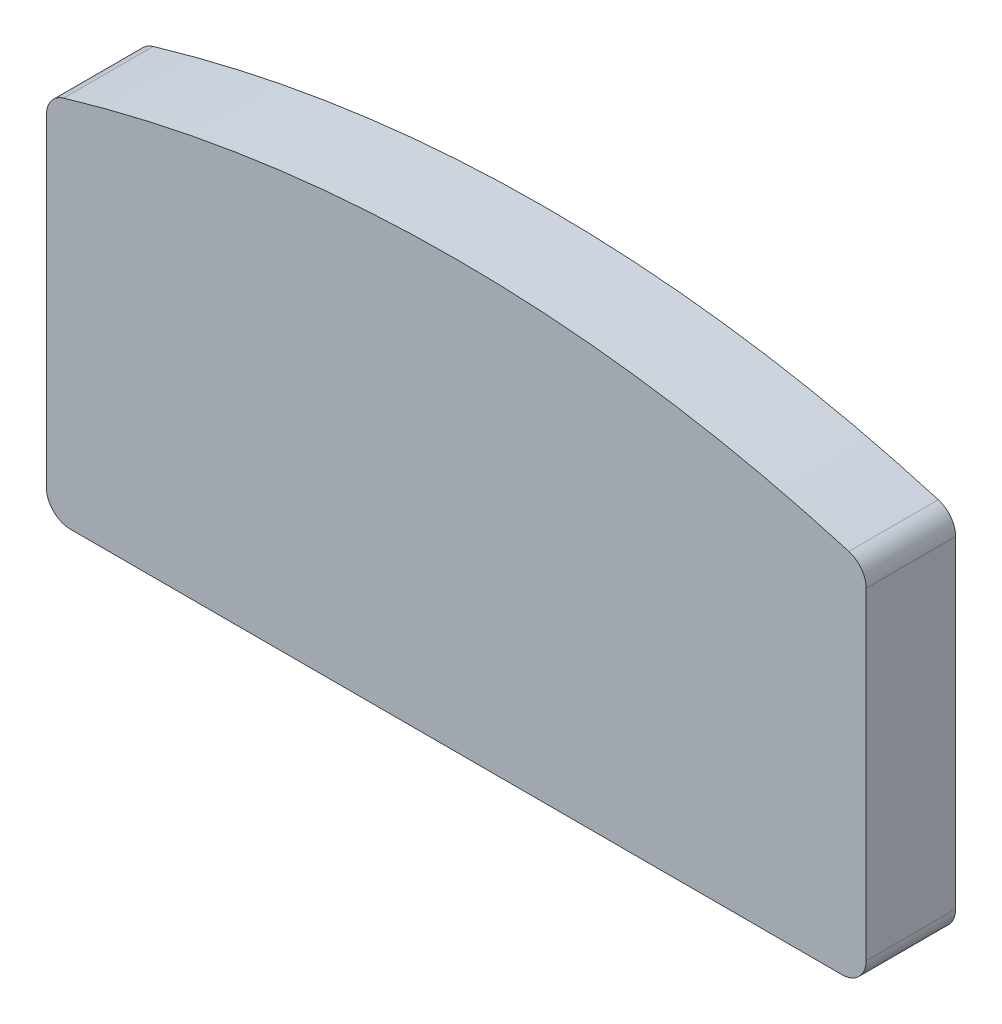
from build123d import *

# Parameters (mm, degrees)
SKETCH1_R          = 1.95
EXTRUDE1_DEPTH     = 3.8
EXTRUDE2_DEPTH     = 7.4
SKETCH4_W          = 0.314102564
SKETCH4_H          = 2.557692308
SKETCH4_H_2        = 3.58974359
CUT_EXTRUDE1_DEPTH = 0.5
SKETCH5_W          = 93.39923337
SKETCH5_H          = 72.269956342
CUT_EXTRUDE2_DEPTH = 3.8


with BuildPart() as part:
    # Sketch1 → Extrude1 (new body)
    with BuildSketch(Plane.XY):
        with BuildLine():
            Line((26.8, -44.15), (33.8, -44.15))
            ThreePointArc((33.8, -44.15), (34.507106781, -43.857106781), (34.8, -43.15))
            Line((34.8, -43.15), (34.8, -2.95))
            ThreePointArc((34.8, -2.95), (34.507106781, -2.242893219), (33.8, -1.95))
            Line((33.8, -1.95), (11.054410884, -1.95))
            ThreePointArc((11.054410884, -1.95), (8.625166624, -1.056794064), (7.35315724, 1.197321429))
            ThreePointArc((7.35315724, 1.197321429), (0, 7.45), (-7.35315724, 1.197321429))
            ThreePointArc((-7.35315724, 1.197321429), (-8.625166624, -1.056794064), (-11.054410884, -1.95))
            Line((-11.054410884, -1.95), (-33.8, -1.95))
            ThreePointArc((-33.8, -1.95), (-34.507106781, -2.242893219), (-34.8, -2.95))
            Line((-34.8, -2.95), (-34.8, -43.15))
            ThreePointArc((-34.8, -43.15), (-34.507106781, -43.857106781), (-33.8, -44.15))
            Line((-33.8, -44.15), (-26.8, -44.15))
            ThreePointArc((-26.8, -44.15), (0, -41.75), (26.8, -44.15))
        make_face()
        with Locations(Location((0, 0, 0), (0, 0, 180))):
            Circle(SKETCH1_R, mode=Mode.SUBTRACT)
    extrude(amount=EXTRUDE1_DEPTH)

    # Sketch2 → Extrude2 (add)
    with BuildSketch(Plane(origin=(0, 0, 0), x_dir=(-1, 0, 0), z_dir=(0, 0, -1))):
        with BuildLine():
            Line((-33.9, -11.717896802), (-33.9, -38.4))
            ThreePointArc((-33.9, -38.4), (-33.314213562, -39.814213562), (-31.9, -40.4))
            Line((-31.9, -40.4), (31.9, -40.4))
            ThreePointArc((31.9, -40.4), (33.314213562, -39.814213562), (33.9, -38.4))
            Line((33.9, -38.4), (33.9, -11.717896802))
            ThreePointArc((33.9, -11.717896802), (33.50223632, -10.520884365), (32.467161226, -9.8))
            ThreePointArc((32.467161226, -9.8), (0, -5.1), (-32.467161226, -9.8))
            ThreePointArc((-32.467161226, -9.8), (-33.50223632, -10.520884365), (-33.9, -11.717896802))
        make_face()
    extrude(amount=EXTRUDE2_DEPTH)

    # Sketch4 → Cut-Extrude1 (cut)
    # profile 1 of 39: a face of its own
    with BuildSketch(Plane.XY.offset(3.8)):
        Polygon((-22.775641026, -10.45), (-22.451021635, -10.45), (-21.766025641, -13.016806891), (-20.747295673, -10.45), (-20.701722756, -10.45), (-19.701923077, -12.999278846), (-19.013421474, -10.45), (-18.692307692, -10.45), (-19.636017628, -13.95), (-19.680889423, -13.95), (-20.733974359, -11.273116987), (-21.799679487, -13.95), (-21.844551282, -13.95), align=None)
    # profile 2 of 39: a face of its own
    with BuildSketch(Plane.XY.offset(3.8)):
        with BuildLine():
            add(Edge.make_bspline(
                [(-18.04306891, -10.315384615), (-18.023577594, -10.316288768), (-17.985409855, -10.318059272), (-17.930216587, -10.333220749), (-17.879959575, -10.358920434), (-17.835381842, -10.393400115), (-17.797129955, -10.433949559), (-17.770349245, -10.481210527), (-17.753136849, -10.532269166), (-17.751058294, -10.567884255), (-17.75, -10.586017628)],
                knots=[0, 0, 0, 0, 1.055194115, 2.066272739, 3.074728998, 4.095836921, 5.109056067, 6.073838105, 7.019297344, 8, 8, 8, 8], degree=3))
            add(Edge.make_bspline(
                [(-17.75, -10.586017628), (-17.75108216, -10.603680281), (-17.753221462, -10.638597256), (-17.77033595, -10.688770728), (-17.797358188, -10.735375012), (-17.835357313, -10.775845722), (-17.879966074, -10.810306342), (-17.93021486, -10.836011081), (-17.985410309, -10.851171218), (-18.023577748, -10.852941907), (-18.04306891, -10.853846154)],
                knots=[0, 0, 0, 0, 0.96129708, 1.900370562, 2.859976407, 3.87933698, 4.906634145, 5.921202961, 6.938410037, 8, 8, 8, 8], degree=3))
            add(Edge.make_bspline(
                [(-18.04306891, -10.853846154), (-18.062337185, -10.852976434), (-18.099840366, -10.851283637), (-18.154207208, -10.835713619), (-18.204035697, -10.810297546), (-18.24870037, -10.776071361), (-18.285930563, -10.735126464), (-18.313028889, -10.68879917), (-18.33010385, -10.638590015), (-18.332248479, -10.603677849), (-18.333333333, -10.586017628)],
                knots=[0, 0, 0, 0, 1.054934014, 2.053291228, 3.073705704, 4.106921865, 5.123545215, 6.088680038, 7.033164197, 8, 8, 8, 8], degree=3))
            add(Edge.make_bspline(
                [(-18.333333333, -10.586017628), (-18.332272247, -10.567886779), (-18.330188206, -10.532276646), (-18.31301609, -10.481181613), (-18.286156282, -10.434200111), (-18.248675718, -10.393174612), (-18.204042258, -10.358929177), (-18.154205513, -10.333518196), (-18.099840813, -10.317946856), (-18.062337337, -10.316254242), (-18.04306891, -10.315384615)],
                knots=[0, 0, 0, 0, 0.98631895, 1.937192651, 2.907499808, 3.917963147, 4.944918757, 5.95915025, 6.951458133, 8, 8, 8, 8], degree=3))
        make_face()
    # profile 3 of 39: a face of its own
    with BuildSketch(Plane.XY.offset(3.8)):
        with Locations((-18.041666667, -12.671153846)):
            Rectangle(SKETCH4_W, SKETCH4_H)
    # profile 4 of 39: a face of its own
    with BuildSketch(Plane.XY.offset(3.8)):
        with Locations((-17.009615385, -12.155128205)):
            Rectangle(SKETCH4_W, SKETCH4_H_2)
    # profile 5 of 39: a face of its own
    with BuildSketch(Plane.XY.offset(3.8)):
        with Locations((-16.022435897, -12.155128205)):
            Rectangle(SKETCH4_W, SKETCH4_H_2)
    # profile 6 of 39: a face of its own
    with BuildSketch(Plane.XY.offset(3.8)):
        Polygon((-15.506410256, -11.392307692), (-15.169170673, -11.392307692), (-14.407051282, -13.232051282), (-13.572015224, -11.392307692), (-13.518729968, -11.392307692), (-12.701923077, -13.232051282), (-11.932792468, -11.392307692), (-11.602564103, -11.392307692), (-12.67177484, -13.95), (-12.736979167, -13.95), (-13.554487179, -12.11025641), (-14.388822115, -13.95), (-14.447015224, -13.95), align=None)
    # profile 7 of 39: a face of its own
    with BuildSketch(Plane.XY.offset(3.8)):
        with BuildLine():
            add(Edge.make_bspline(
                [(-9.963341346, -11.347435897), (-9.915350073, -11.348457789), (-9.821250916, -11.350461467), (-9.68344303, -11.371876433), (-9.551897894, -11.404623797), (-9.426111702, -11.449895359), (-9.307695406, -11.51057731), (-9.194924162, -11.582986601), (-9.088107153, -11.668769195), (-9.024084124, -11.735127263), (-8.991586538, -11.768810096)],
                knots=[0, 0, 0, 0, 1.054011418, 2.066658804, 3.057071809, 4.030435133, 4.997543892, 5.974964718, 6.972108034, 8, 8, 8, 8], degree=3))
            add(Edge.make_bspline(
                [(-8.991586538, -11.768810096), (-8.963604584, -11.801024082), (-8.908182204, -11.864828624), (-8.837116485, -11.968284237), (-8.775894925, -12.075424338), (-8.726831964, -12.187671664), (-8.688146941, -12.304046336), (-8.660681244, -12.424948347), (-8.644344309, -12.550110694), (-8.642141342, -12.635114532), (-8.641025641, -12.678165064)],
                knots=[0, 0, 0, 0, 1.025258237, 2.030674902, 3.01204498, 3.988269485, 4.97094183, 5.956517959, 6.965070386, 8, 8, 8, 8], degree=3))
            add(Edge.make_bspline(
                [(-8.641025641, -12.678165064), (-8.642006978, -12.721465122), (-8.643946147, -12.807028055), (-8.662289763, -12.933047421), (-8.690820849, -13.055242244), (-8.731652687, -13.173100937), (-8.784010796, -13.286983765), (-8.847901484, -13.396393314), (-8.923773101, -13.501545447), (-9.009777098, -13.601547286), (-9.104828974, -13.6937135), (-9.207945122, -13.77404177), (-9.317099156, -13.842863294), (-9.433742509, -13.89829971), (-9.556809996, -13.94200941), (-9.686567064, -13.972709427), (-9.822812135, -13.99127111), (-9.915839356, -13.993654684), (-9.963341346, -13.994871795)],
                knots=[0, 0, 0, 0, 0.998656419, 1.973391657, 2.932242238, 3.890759089, 4.846373663, 5.82037756, 6.809684879, 7.83454468, 8.860553229, 9.859544525, 10.845671541, 11.83227036, 12.833544569, 13.85385346, 14.904124723, 16, 16, 16, 16], degree=3))
            add(Edge.make_bspline(
                [(-9.963341346, -13.994871795), (-10.011076066, -13.993650599), (-10.104566925, -13.991258824), (-10.241292907, -13.972781541), (-10.371282526, -13.942023559), (-10.494511125, -13.898156066), (-10.611655972, -13.842861522), (-10.721442469, -13.774249833), (-10.824642384, -13.693689678), (-10.919714369, -13.601553741), (-11.005712974, -13.501543784), (-11.081585982, -13.396393746), (-11.145476308, -13.286983652), (-11.197834512, -13.173100967), (-11.238666325, -13.055242236), (-11.267197418, -12.933047423), (-11.285541032, -12.807028055), (-11.287480201, -12.721465122), (-11.288461538, -12.678165064)],
                knots=[0, 0, 0, 0, 1.099876186, 2.154163076, 3.173186993, 4.173200201, 5.163417411, 6.152872554, 7.150605724, 8.17532212, 9.198891216, 10.186952605, 11.159729845, 12.11414092, 13.071450619, 14.029093627, 15.002601286, 16, 16, 16, 16], degree=3))
            add(Edge.make_bspline(
                [(-11.288461538, -12.678165064), (-11.287338228, -12.635348518), (-11.285114267, -12.550579116), (-11.268793758, -12.425652055), (-11.241435201, -12.304954666), (-11.202703805, -12.18902919), (-11.153188614, -12.077273754), (-11.092827326, -11.969868923), (-11.021036693, -11.866881123), (-10.965834742, -11.803159043), (-10.937900641, -11.770913462)],
                knots=[0, 0, 0, 0, 1.031353054, 2.041901799, 3.029428768, 4.008703097, 4.981709435, 5.96992636, 6.972712378, 8, 8, 8, 8], degree=3))
            add(Edge.make_bspline(
                [(-10.937900641, -11.770913462), (-10.90545205, -11.736938522), (-10.841636186, -11.670120826), (-10.734287458, -11.584588302), (-10.621793637, -11.510672228), (-10.502068711, -11.451196013), (-10.376385853, -11.404357495), (-10.244166611, -11.37179198), (-10.105891095, -11.350538625), (-10.011331474, -11.348480447), (-9.963341346, -11.347435897)],
                knots=[0, 0, 0, 0, 1.027980169, 2.021703884, 2.998553061, 3.971491411, 4.943284454, 5.930300938, 6.949603206, 8, 8, 8, 8], degree=3))
        make_face()
        with BuildLine():
            add(Edge.make_bspline(
                [(-9.96474359, -11.661538462), (-9.998681201, -11.662503053), (-10.06568033, -11.664407336), (-10.164299914, -11.67889124), (-10.259240068, -11.701838745), (-10.350680913, -11.734442801), (-10.438314085, -11.7765417), (-10.522223487, -11.82825006), (-10.602655927, -11.888883016), (-10.678037991, -11.958345688), (-10.747220303, -12.034224683), (-10.807698279, -12.115073041), (-10.859123386, -12.199579388), (-10.901963545, -12.287831599), (-10.933870733, -12.380724013), (-10.957043755, -12.477204644), (-10.971513996, -12.57747006), (-10.973400374, -12.645631079), (-10.974358974, -12.680268429)],
                knots=[0, 0, 0, 0, 1.021534396, 2.016698045, 2.994645724, 3.958388632, 4.93408049, 5.916473867, 6.921342795, 7.962252576, 8.998418191, 10.008913653, 10.997312074, 11.973003931, 12.956656626, 13.948281152, 14.957379055, 16, 16, 16, 16], degree=3))
            add(Edge.make_bspline(
                [(-10.974358974, -12.680268429), (-10.972752151, -12.725020457), (-10.969562906, -12.813844862), (-10.94362767, -12.944655985), (-10.90024139, -13.070237837), (-10.84165411, -13.189854223), (-10.768247892, -13.300526501), (-10.681760825, -13.399197985), (-10.583121125, -13.484383797), (-10.473504624, -13.555064642), (-10.355150306, -13.611224398), (-10.229893985, -13.651023374), (-10.099253291, -13.676895066), (-10.00997256, -13.679466541), (-9.96474359, -13.680769231)],
                knots=[0, 0, 0, 0, 1.016792936, 2.018143844, 3.017858371, 4.030088057, 5.03801393, 6.028138512, 7.003788237, 7.991172063, 8.984598303, 9.972568034, 10.972917682, 12, 12, 12, 12], degree=3))
            add(Edge.make_bspline(
                [(-9.96474359, -13.680769231), (-9.919517221, -13.679458951), (-9.830241625, -13.676872494), (-9.699782448, -13.651153674), (-9.574868476, -13.611050013), (-9.456637089, -13.555127803), (-9.347070485, -13.484115389), (-9.247721364, -13.399679012), (-9.161972753, -13.30026516), (-9.088639148, -13.189707631), (-9.029092405, -13.070423279), (-8.985909203, -12.944632807), (-8.959911617, -12.813850765), (-8.956730789, -12.725022434), (-8.955128205, -12.680268429)],
                knots=[0, 0, 0, 0, 1.02726834, 2.027799167, 3.010890988, 4.004497153, 4.992059811, 5.971914811, 6.958719428, 7.966827853, 8.981595046, 9.981490638, 10.983022906, 12, 12, 12, 12], degree=3))
            add(Edge.make_bspline(
                [(-8.955128205, -12.680268429), (-8.956086475, -12.645630872), (-8.957972204, -12.577469446), (-8.972447169, -12.477206993), (-8.995602708, -12.380715396), (-9.027574326, -12.287863393), (-9.070228339, -12.199350888), (-9.122645132, -12.115321161), (-9.182876158, -12.033944615), (-9.252893279, -11.958590974), (-9.328196657, -11.888855938), (-9.408661695, -11.828226548), (-9.492446673, -11.776768953), (-9.579825256, -11.734082712), (-9.671277824, -11.702135372), (-9.766084953, -11.678758741), (-9.864283763, -11.664468544), (-9.931042806, -11.662521402), (-9.96474359, -11.661538462)],
                knots=[0, 0, 0, 0, 1.042956736, 2.052379634, 3.044323526, 4.02829302, 5.004299113, 5.996692471, 7.007513377, 8.048758398, 9.090003419, 10.095195979, 11.07790575, 12.047570684, 13.018257071, 13.989683339, 14.985167495, 16, 16, 16, 16], degree=3))
        make_face(mode=Mode.SUBTRACT)
    # profile 8 of 39: a face of its own
    with BuildSketch(Plane.XY.offset(3.8)):
        with BuildLine():
            add(Edge.make_bspline(
                [(-6.77744391, -11.347435897), (-6.729452637, -11.348457789), (-6.63535348, -11.350461467), (-6.497545594, -11.371876433), (-6.366000458, -11.404623797), (-6.240214266, -11.449895359), (-6.12179797, -11.51057731), (-6.009026726, -11.582986601), (-5.902209717, -11.668769195), (-5.838186688, -11.735127263), (-5.805689103, -11.768810096)],
                knots=[0, 0, 0, 0, 1.054011418, 2.066658804, 3.057071809, 4.030435133, 4.997543892, 5.974964718, 6.972108034, 8, 8, 8, 8], degree=3))
            add(Edge.make_bspline(
                [(-5.805689103, -11.768810096), (-5.777707148, -11.801024082), (-5.722284768, -11.864828624), (-5.651219049, -11.968284237), (-5.589997489, -12.075424338), (-5.540934528, -12.187671664), (-5.502249505, -12.304046336), (-5.474783808, -12.424948347), (-5.458446873, -12.550110694), (-5.456243907, -12.635114532), (-5.455128205, -12.678165064)],
                knots=[0, 0, 0, 0, 1.025258237, 2.030674902, 3.01204498, 3.988269485, 4.97094183, 5.956517959, 6.965070386, 8, 8, 8, 8], degree=3))
            add(Edge.make_bspline(
                [(-5.455128205, -12.678165064), (-5.456109542, -12.721465122), (-5.458048711, -12.807028055), (-5.476392327, -12.933047421), (-5.504923413, -13.055242244), (-5.545755251, -13.173100937), (-5.59811336, -13.286983765), (-5.662004048, -13.396393314), (-5.737875665, -13.501545447), (-5.823879662, -13.601547286), (-5.918931538, -13.6937135), (-6.022047686, -13.77404177), (-6.13120172, -13.842863294), (-6.247845073, -13.89829971), (-6.37091256, -13.94200941), (-6.500669628, -13.972709427), (-6.636914699, -13.99127111), (-6.72994192, -13.993654684), (-6.77744391, -13.994871795)],
                knots=[0, 0, 0, 0, 0.998656419, 1.973391657, 2.932242238, 3.890759089, 4.846373663, 5.82037756, 6.809684879, 7.83454468, 8.860553229, 9.859544525, 10.845671541, 11.83227036, 12.833544569, 13.85385346, 14.904124723, 16, 16, 16, 16], degree=3))
            add(Edge.make_bspline(
                [(-6.77744391, -13.994871795), (-6.82517863, -13.993650599), (-6.918669489, -13.991258824), (-7.055395471, -13.972781541), (-7.18538509, -13.942023559), (-7.308613689, -13.898156066), (-7.425758536, -13.842861522), (-7.535545033, -13.774249833), (-7.638744948, -13.693689678), (-7.733816933, -13.601553741), (-7.819815538, -13.501543784), (-7.895688546, -13.396393746), (-7.959578873, -13.286983652), (-8.011937076, -13.173100967), (-8.052768889, -13.055242236), (-8.081299982, -12.933047423), (-8.099643597, -12.807028055), (-8.101582765, -12.721465122), (-8.102564103, -12.678165064)],
                knots=[0, 0, 0, 0, 1.099876186, 2.154163076, 3.173186993, 4.173200201, 5.163417411, 6.152872554, 7.150605724, 8.17532212, 9.198891216, 10.186952605, 11.159729845, 12.11414092, 13.071450619, 14.029093627, 15.002601286, 16, 16, 16, 16], degree=3))
            add(Edge.make_bspline(
                [(-8.102564103, -12.678165064), (-8.101440792, -12.635348518), (-8.099216831, -12.550579116), (-8.082896322, -12.425652055), (-8.055537765, -12.304954666), (-8.016806369, -12.18902919), (-7.967291178, -12.077273754), (-7.90692989, -11.969868923), (-7.835139257, -11.866881123), (-7.779937306, -11.803159043), (-7.752003205, -11.770913462)],
                knots=[0, 0, 0, 0, 1.031353054, 2.041901799, 3.029428768, 4.008703097, 4.981709435, 5.96992636, 6.972712378, 8, 8, 8, 8], degree=3))
            add(Edge.make_bspline(
                [(-7.752003205, -11.770913462), (-7.719554614, -11.736938522), (-7.65573875, -11.670120826), (-7.548390023, -11.584588302), (-7.435896201, -11.510672228), (-7.316171275, -11.451196013), (-7.190488417, -11.404357495), (-7.058269175, -11.37179198), (-6.919993659, -11.350538625), (-6.825434038, -11.348480447), (-6.77744391, -11.347435897)],
                knots=[0, 0, 0, 0, 1.027980169, 2.021703884, 2.998553061, 3.971491411, 4.943284454, 5.930300938, 6.949603206, 8, 8, 8, 8], degree=3))
        make_face()
        with BuildLine():
            add(Edge.make_bspline(
                [(-6.778846154, -11.661538462), (-6.812783765, -11.662503053), (-6.879782894, -11.664407336), (-6.978402479, -11.67889124), (-7.073342632, -11.701838745), (-7.164783477, -11.734442801), (-7.252416649, -11.7765417), (-7.336326051, -11.82825006), (-7.416758491, -11.888883016), (-7.492140555, -11.958345688), (-7.561322867, -12.034224683), (-7.621800843, -12.115073041), (-7.67322595, -12.199579388), (-7.716066109, -12.287831599), (-7.747973297, -12.380724013), (-7.771146319, -12.477204644), (-7.78561656, -12.57747006), (-7.787502938, -12.645631079), (-7.788461538, -12.680268429)],
                knots=[0, 0, 0, 0, 1.021534396, 2.016698045, 2.994645724, 3.958388632, 4.93408049, 5.916473867, 6.921342795, 7.962252576, 8.998418191, 10.008913653, 10.997312074, 11.973003931, 12.956656626, 13.948281152, 14.957379055, 16, 16, 16, 16], degree=3))
            add(Edge.make_bspline(
                [(-7.788461538, -12.680268429), (-7.786854715, -12.725020457), (-7.78366547, -12.813844862), (-7.757730234, -12.944655985), (-7.714343954, -13.070237837), (-7.655756674, -13.189854223), (-7.582350456, -13.300526501), (-7.495863389, -13.399197985), (-7.397223689, -13.484383797), (-7.287607188, -13.555064642), (-7.169252871, -13.611224398), (-7.043996549, -13.651023374), (-6.913355855, -13.676895066), (-6.824075124, -13.679466541), (-6.778846154, -13.680769231)],
                knots=[0, 0, 0, 0, 1.016792936, 2.018143844, 3.017858371, 4.030088057, 5.03801393, 6.028138512, 7.003788237, 7.991172063, 8.984598303, 9.972568034, 10.972917682, 12, 12, 12, 12], degree=3))
            add(Edge.make_bspline(
                [(-6.778846154, -13.680769231), (-6.733619785, -13.679458951), (-6.644344189, -13.676872494), (-6.513885012, -13.651153674), (-6.38897104, -13.611050013), (-6.270739653, -13.555127803), (-6.161173049, -13.484115389), (-6.061823928, -13.399679012), (-5.976075317, -13.30026516), (-5.902741712, -13.189707631), (-5.843194969, -13.070423279), (-5.800011767, -12.944632807), (-5.774014182, -12.813850765), (-5.770833353, -12.725022434), (-5.769230769, -12.680268429)],
                knots=[0, 0, 0, 0, 1.02726834, 2.027799167, 3.010890988, 4.004497153, 4.992059811, 5.971914811, 6.958719428, 7.966827853, 8.981595046, 9.981490638, 10.983022906, 12, 12, 12, 12], degree=3))
            add(Edge.make_bspline(
                [(-5.769230769, -12.680268429), (-5.770189039, -12.645630872), (-5.772074768, -12.577469446), (-5.786549733, -12.477206993), (-5.809705272, -12.380715396), (-5.84167689, -12.287863393), (-5.884330904, -12.199350888), (-5.936747697, -12.115321161), (-5.996978722, -12.033944615), (-6.066995843, -11.958590974), (-6.142299221, -11.888855938), (-6.222764259, -11.828226548), (-6.306549238, -11.776768953), (-6.39392782, -11.734082712), (-6.485380388, -11.702135372), (-6.580187517, -11.678758741), (-6.678386327, -11.664468544), (-6.74514537, -11.662521402), (-6.778846154, -11.661538462)],
                knots=[0, 0, 0, 0, 1.042956736, 2.052379634, 3.044323526, 4.02829302, 5.004299113, 5.996692471, 7.007513377, 8.048758398, 9.090003419, 10.095195979, 11.07790575, 12.047570684, 13.018257071, 13.989683339, 14.985167495, 16, 16, 16, 16], degree=3))
        make_face(mode=Mode.SUBTRACT)
    # profile 9 of 39: a face of its own
    with BuildSketch(Plane.XY.offset(3.8)):
        with BuildLine():
            Line((-2.224358974, -10.36025641), (-2.224358974, -13.95))
            Line((-2.224358974, -13.95), (-2.538461538, -13.95))
            Line((-2.538461538, -13.95), (-2.538461538, -13.507592147))
            add(Edge.make_bspline(
                [(-2.538461538, -13.507592147), (-2.573880329, -13.547631741), (-2.643000544, -13.625769512), (-2.758441662, -13.727851685), (-2.88080984, -13.812230007), (-3.009511161, -13.880379922), (-3.144429405, -13.931571979), (-3.285265492, -13.967958138), (-3.432076873, -13.991351973), (-3.532329228, -13.993687995), (-3.583133013, -13.994871795)],
                knots=[0, 0, 0, 0, 1.074387032, 2.096679803, 3.090159297, 4.057316773, 5.018401886, 5.985159533, 6.978961417, 8, 8, 8, 8], degree=3))
            add(Edge.make_bspline(
                [(-3.583133013, -13.994871795), (-3.628300967, -13.993645423), (-3.717374172, -13.991226962), (-3.848403249, -13.972464659), (-3.974495498, -13.942334037), (-4.095770071, -13.900433147), (-4.211442216, -13.844852326), (-4.322502313, -13.778311078), (-4.428375005, -13.699070248), (-4.527446544, -13.608482219), (-4.618678544, -13.510087232), (-4.698739817, -13.405141685), (-4.765492897, -13.294099381), (-4.821312977, -13.178366227), (-4.864309322, -13.057051308), (-4.894282956, -12.93057414), (-4.913023403, -12.799084266), (-4.915440864, -12.709544743), (-4.916666667, -12.664142628)],
                knots=[0, 0, 0, 0, 1.033919861, 2.038935746, 3.024066025, 3.998881131, 4.97069526, 5.957263378, 6.95902576, 7.993208707, 9.027059324, 10.027763471, 11.009749337, 11.988697705, 12.965288445, 13.950418724, 14.960734635, 16, 16, 16, 16], degree=3))
            add(Edge.make_bspline(
                [(-4.916666667, -12.664142628), (-4.915413695, -12.619678925), (-4.912936638, -12.531776581), (-4.894483419, -12.402497883), (-4.86345241, -12.277979623), (-4.819904562, -12.158622679), (-4.764062607, -12.044282629), (-4.69613452, -11.934878604), (-4.616115396, -11.830109207), (-4.523862989, -11.73243798), (-4.423928218, -11.642217366), (-4.317019488, -11.56380832), (-4.205796206, -11.496091471), (-4.088533196, -11.442437995), (-3.966966091, -11.399028891), (-3.840012645, -11.368995922), (-3.708201066, -11.351298601), (-3.618710574, -11.348735837), (-3.573317308, -11.347435897)],
                knots=[0, 0, 0, 0, 1.020392517, 2.01726096, 2.990465484, 3.961182959, 4.928053699, 5.906110375, 6.912531644, 7.948652711, 8.985773172, 9.998621852, 10.987621588, 11.969261332, 12.953316658, 13.946091881, 14.958173133, 16, 16, 16, 16], degree=3))
            add(Edge.make_bspline(
                [(-3.573317308, -11.347435897), (-3.5211005, -11.349002993), (-3.418604709, -11.352079029), (-3.268706188, -11.377785396), (-3.126918577, -11.420948274), (-2.99242559, -11.480039555), (-2.86602903, -11.556840306), (-2.746802389, -11.649591754), (-2.636819066, -11.7609189), (-2.571747244, -11.844530474), (-2.538461538, -11.887299679)],
                knots=[0, 0, 0, 0, 1.031072012, 2.023879775, 2.993683497, 3.952812103, 4.918022106, 5.908088563, 6.929940113, 8, 8, 8, 8], degree=3))
            Line((-2.538461538, -11.887299679), (-2.538461538, -10.36025641))
            Line((-2.538461538, -10.36025641), (-2.224358974, -10.36025641))
        make_face()
        with BuildLine():
            add(Edge.make_bspline(
                [(-3.569110577, -11.661538462), (-3.615024915, -11.663172099), (-3.705652515, -11.66639664), (-3.838696517, -11.691570135), (-3.966009931, -11.73345473), (-4.086956005, -11.790736631), (-4.199624222, -11.862765368), (-4.300317893, -11.949886751), (-4.389860594, -12.049723765), (-4.465168858, -12.161825875), (-4.526559355, -12.282003967), (-4.569726387, -12.407628405), (-4.598195634, -12.536433382), (-4.601104155, -12.623796068), (-4.602564103, -12.667648237)],
                knots=[0, 0, 0, 0, 1.031046209, 2.035121221, 3.029706178, 4.034933723, 5.034054252, 6.02443088, 7.017295772, 8.038157696, 9.050218397, 10.03989886, 11.016116709, 12, 12, 12, 12], degree=3))
            add(Edge.make_bspline(
                [(-4.602564103, -12.667648237), (-4.600699209, -12.711238344), (-4.596976732, -12.7982477), (-4.570226038, -12.927228277), (-4.525346165, -13.052882319), (-4.464104102, -13.174143313), (-4.387417477, -13.286727413), (-4.298528825, -13.388467536), (-4.196578543, -13.475957124), (-4.083651036, -13.549194697), (-3.963043066, -13.608357218), (-3.836209134, -13.649522858), (-3.705533496, -13.676100638), (-3.616681162, -13.679205115), (-3.571915064, -13.680769231)],
                knots=[0, 0, 0, 0, 0.979072187, 1.954306742, 2.945804271, 3.96968567, 4.997920485, 5.998718438, 6.996577872, 8.005894225, 9.015743152, 10.005417472, 10.995077863, 12, 12, 12, 12], degree=3))
            add(Edge.make_bspline(
                [(-3.571915064, -13.680769231), (-3.526468561, -13.679109267), (-3.436079975, -13.675807763), (-3.302641267, -13.650526498), (-3.173146304, -13.6087577), (-3.049359076, -13.550858573), (-2.934042945, -13.479101217), (-2.830545067, -13.395094126), (-2.743029099, -13.297390942), (-2.668836489, -13.190014489), (-2.610661072, -13.072302492), (-2.568285013, -12.946968302), (-2.543231107, -12.814007553), (-2.540073378, -12.723143626), (-2.538461538, -12.676762821)],
                knots=[0, 0, 0, 0, 1.01762866, 2.023962475, 3.030623092, 4.058876274, 5.077231937, 6.066672613, 7.034107872, 8.005628644, 8.981990164, 9.965428785, 10.961468474, 12, 12, 12, 12], degree=3))
            add(Edge.make_bspline(
                [(-2.538461538, -12.676762821), (-2.539421195, -12.64142499), (-2.541310102, -12.571868957), (-2.555740672, -12.469741439), (-2.578695598, -12.372007713), (-2.611041768, -12.278565024), (-2.653533053, -12.189930009), (-2.704780819, -12.105466248), (-2.765686268, -12.025613037), (-2.835268964, -11.951469966), (-2.911434167, -11.883843504), (-2.992028708, -11.823479263), (-3.078007454, -11.77389049), (-3.167924491, -11.732849219), (-3.261935826, -11.700190069), (-3.360806446, -11.678402375), (-3.463485433, -11.663442054), (-3.533531488, -11.662179673), (-3.569110577, -11.661538462)],
                knots=[0, 0, 0, 0, 1.050140795, 2.067009409, 3.05949893, 4.030605086, 5.00011959, 5.97591094, 6.962425594, 7.979863591, 8.993523472, 9.986985069, 10.967611495, 11.937549037, 12.921786183, 13.919465291, 14.943216303, 16, 16, 16, 16], degree=3))
        make_face(mode=Mode.SUBTRACT)
    # profile 10 of 39: a face of its own
    with BuildSketch(Plane.XY.offset(3.8)):
        with BuildLine():
            Line((-0.070512821, -10.45), (0.615885417, -10.45))
            add(Edge.make_bspline(
                [(0.615885417, -10.45), (0.663096323, -10.450051896), (0.753554516, -10.450151332), (0.883269571, -10.453166078), (1.001079303, -10.45719277), (1.106729684, -10.462774663), (1.200545782, -10.469371253), (1.282103082, -10.478623292), (1.352042638, -10.488283588), (1.393949087, -10.498104995), (1.413060897, -10.502584135)],
                knots=[0, 0, 0, 0, 1.415646017, 2.712440637, 3.8905458, 4.950247383, 5.884950622, 6.709939814, 7.411656543, 8, 8, 8, 8], degree=3))
            add(Edge.make_bspline(
                [(1.413060897, -10.502584135), (1.437254431, -10.509206084), (1.485071408, -10.522293946), (1.553972452, -10.54850767), (1.619526297, -10.579589835), (1.681957855, -10.615013775), (1.740499939, -10.656299339), (1.796025979, -10.701772957), (1.84804596, -10.752484525), (1.896267352, -10.807865265), (1.940552149, -10.866985475), (1.978681832, -10.930727705), (2.010609059, -10.998019008), (2.037992331, -11.068812579), (2.057700785, -11.143702903), (2.072547685, -11.222169615), (2.081971312, -11.304204305), (2.082873874, -11.360264173), (2.083333333, -11.388802083)],
                knots=[0, 0, 0, 0, 0.999701418, 1.975846123, 2.934577507, 3.890451536, 4.834027766, 5.787354733, 6.749476667, 7.726910423, 8.712836071, 9.690891519, 10.682875813, 11.679750201, 12.712814741, 13.765529915, 14.8625177, 16, 16, 16, 16], degree=3))
            add(Edge.make_bspline(
                [(2.083333333, -11.388802083), (2.082911909, -11.41757986), (2.082087363, -11.473885524), (2.072191077, -11.556258312), (2.058860886, -11.634976702), (2.038363833, -11.709866153), (2.01151816, -11.780481923), (1.980026107, -11.847903155), (1.942042577, -11.910982827), (1.898397747, -11.969949945), (1.849846153, -12.024859857), (1.796593215, -12.075314652), (1.738853922, -12.12101899), (1.676811774, -12.162075334), (1.609861925, -12.197531613), (1.539019772, -12.229288918), (1.463669555, -12.255959979), (1.411527041, -12.26999004), (1.385016026, -12.277123397)],
                knots=[0, 0, 0, 0, 1.121902311, 2.195077645, 3.232258892, 4.234102512, 5.217864754, 6.176164875, 7.132989551, 8.084763148, 9.034132444, 9.988522005, 10.94243251, 11.903244335, 12.886203696, 13.894208494, 14.929344452, 16, 16, 16, 16], degree=3))
            add(Edge.make_bspline(
                [(1.385016026, -12.277123397), (1.363088692, -12.281786379), (1.315033664, -12.292005573), (1.235890942, -12.30341403), (1.143745556, -12.31315163), (1.038723276, -12.320452768), (0.920918371, -12.326703136), (0.790267114, -12.33167123), (0.646513037, -12.334401084), (0.546241793, -12.334541877), (0.493890224, -12.334615385)],
                knots=[0, 0, 0, 0, 0.601384939, 1.31797006, 2.144135048, 3.087295005, 4.142315834, 5.309527816, 6.595305764, 8, 8, 8, 8], degree=3))
            Line((0.493890224, -12.334615385), (0.243589744, -12.334615385))
            Line((0.243589744, -12.334615385), (0.243589744, -13.95))
            Line((0.243589744, -13.95), (-0.070512821, -13.95))
            Line((-0.070512821, -13.95), (-0.070512821, -10.45))
        make_face()
        with BuildLine():
            Line((0.243589744, -10.808974359), (0.243589744, -11.975641026))
            Line((0.243589744, -11.975641026), (0.856370192, -11.983353365))
            add(Edge.make_bspline(
                [(0.856370192, -11.983353365), (0.886290118, -11.983368829), (0.944049918, -11.983398681), (1.027486141, -11.979413458), (1.104895429, -11.974812925), (1.176040004, -11.968077002), (1.240951938, -11.958555744), (1.299739467, -11.948944006), (1.35194675, -11.935038644), (1.413045952, -11.916315574), (1.481129299, -11.884382959), (1.555196848, -11.838033069), (1.617967434, -11.77895236), (1.672285731, -11.712524529), (1.715391609, -11.6386254), (1.746947601, -11.559556463), (1.765488759, -11.476128613), (1.767974952, -11.419040475), (1.769230769, -11.390204327)],
                knots=[0, 0, 0, 0, 1.160613943, 2.240541288, 3.23993089, 4.169200891, 5.011653406, 5.7853311, 6.478053781, 7.106038997, 8.262395093, 9.384106736, 10.481365981, 11.59014053, 12.70357646, 13.786202915, 14.881775077, 16, 16, 16, 16], degree=3))
            add(Edge.make_bspline(
                [(1.769230769, -11.390204327), (1.767968123, -11.362065813), (1.765458138, -11.306129931), (1.746802275, -11.224151171), (1.715452961, -11.145915466), (1.671996366, -11.072942381), (1.619255236, -11.006753577), (1.557955893, -10.94925645), (1.488242632, -10.903034747), (1.423394401, -10.873201466), (1.365793215, -10.85498619), (1.315761255, -10.84224135), (1.25927058, -10.832065743), (1.196302801, -10.823826241), (1.127345967, -10.816772779), (1.051807652, -10.811986802), (0.969974009, -10.809185346), (0.913163438, -10.809046391), (0.883713942, -10.808974359)],
                knots=[0, 0, 0, 0, 1.120700087, 2.227813068, 3.331159281, 4.466773991, 5.599788987, 6.693661531, 7.80175334, 8.91857717, 9.525282508, 10.207424825, 10.974604443, 11.810962634, 12.737642355, 13.736264703, 14.826523623, 16, 16, 16, 16], degree=3))
            Line((0.883713942, -10.808974359), (0.243589744, -10.808974359))
        make_face(mode=Mode.SUBTRACT)
    # profile 11 of 39: a face of its own
    with BuildSketch(Plane.XY.offset(3.8)):
        with BuildLine():
            add(Edge.make_bspline(
                [(3.946915064, -11.347435897), (3.994906337, -11.348457789), (4.089005495, -11.350461467), (4.22681338, -11.371876433), (4.358358516, -11.404623797), (4.484144708, -11.449895359), (4.602561004, -11.51057731), (4.715332248, -11.582986601), (4.822149257, -11.668769195), (4.886172286, -11.735127263), (4.918669872, -11.768810096)],
                knots=[0, 0, 0, 0, 1.054011418, 2.066658804, 3.057071809, 4.030435133, 4.997543892, 5.974964718, 6.972108034, 8, 8, 8, 8], degree=3))
            add(Edge.make_bspline(
                [(4.918669872, -11.768810096), (4.946651826, -11.801024082), (5.002074206, -11.864828624), (5.073139925, -11.968284237), (5.134361485, -12.075424338), (5.183424446, -12.187671664), (5.22210947, -12.304046336), (5.249575166, -12.424948347), (5.265912101, -12.550110694), (5.268115068, -12.635114532), (5.269230769, -12.678165064)],
                knots=[0, 0, 0, 0, 1.025258237, 2.030674902, 3.01204498, 3.988269485, 4.97094183, 5.956517959, 6.965070386, 8, 8, 8, 8], degree=3))
            add(Edge.make_bspline(
                [(5.269230769, -12.678165064), (5.268249432, -12.721465122), (5.266310264, -12.807028055), (5.247966647, -12.933047421), (5.219435561, -13.055242244), (5.178603723, -13.173100937), (5.126245614, -13.286983765), (5.062354926, -13.396393314), (4.986483309, -13.501545447), (4.900479312, -13.601547286), (4.805427436, -13.6937135), (4.702311288, -13.77404177), (4.593157254, -13.842863294), (4.476513901, -13.89829971), (4.353446414, -13.94200941), (4.223689346, -13.972709427), (4.087444276, -13.99127111), (3.994417054, -13.993654684), (3.946915064, -13.994871795)],
                knots=[0, 0, 0, 0, 0.998656419, 1.973391657, 2.932242238, 3.890759089, 4.846373663, 5.82037756, 6.809684879, 7.83454468, 8.860553229, 9.859544525, 10.845671541, 11.83227036, 12.833544569, 13.85385346, 14.904124723, 16, 16, 16, 16], degree=3))
            add(Edge.make_bspline(
                [(3.946915064, -13.994871795), (3.899180345, -13.993650599), (3.805689485, -13.991258824), (3.668963503, -13.972781541), (3.538973884, -13.942023559), (3.415745285, -13.898156066), (3.298600439, -13.842861522), (3.188813942, -13.774249833), (3.085614026, -13.693689678), (2.990542042, -13.601553741), (2.904543436, -13.501543784), (2.828670428, -13.396393746), (2.764780102, -13.286983652), (2.712421898, -13.173100967), (2.671590085, -13.055242236), (2.643058992, -12.933047423), (2.624715378, -12.807028055), (2.622776209, -12.721465122), (2.621794872, -12.678165064)],
                knots=[0, 0, 0, 0, 1.099876186, 2.154163076, 3.173186993, 4.173200201, 5.163417411, 6.152872554, 7.150605724, 8.17532212, 9.198891216, 10.186952605, 11.159729845, 12.11414092, 13.071450619, 14.029093627, 15.002601286, 16, 16, 16, 16], degree=3))
            add(Edge.make_bspline(
                [(2.621794872, -12.678165064), (2.622918182, -12.635348518), (2.625142144, -12.550579116), (2.641462653, -12.425652055), (2.668821209, -12.304954666), (2.707552606, -12.18902919), (2.757067797, -12.077273754), (2.817429084, -11.969868923), (2.889219717, -11.866881123), (2.944421669, -11.803159043), (2.972355769, -11.770913462)],
                knots=[0, 0, 0, 0, 1.031353054, 2.041901799, 3.029428768, 4.008703097, 4.981709435, 5.96992636, 6.972712378, 8, 8, 8, 8], degree=3))
            add(Edge.make_bspline(
                [(2.972355769, -11.770913462), (3.00480436, -11.736938522), (3.068620224, -11.670120826), (3.175968952, -11.584588302), (3.288462773, -11.510672228), (3.408187699, -11.451196013), (3.533870557, -11.404357495), (3.6660898, -11.37179198), (3.804365315, -11.350538625), (3.898924936, -11.348480447), (3.946915064, -11.347435897)],
                knots=[0, 0, 0, 0, 1.027980169, 2.021703884, 2.998553061, 3.971491411, 4.943284454, 5.930300938, 6.949603206, 8, 8, 8, 8], degree=3))
        make_face()
        with BuildLine():
            add(Edge.make_bspline(
                [(3.945512821, -11.661538462), (3.911575209, -11.662503053), (3.844576081, -11.664407336), (3.745956496, -11.67889124), (3.651016342, -11.701838745), (3.559575498, -11.734442801), (3.471942325, -11.7765417), (3.388032923, -11.82825006), (3.307600483, -11.888883016), (3.23221842, -11.958345688), (3.163036108, -12.034224683), (3.102558131, -12.115073041), (3.051133025, -12.199579388), (3.008292866, -12.287831599), (2.976385678, -12.380724013), (2.953212655, -12.477204644), (2.938742415, -12.57747006), (2.936856036, -12.645631079), (2.935897436, -12.680268429)],
                knots=[0, 0, 0, 0, 1.021534396, 2.016698045, 2.994645724, 3.958388632, 4.93408049, 5.916473867, 6.921342795, 7.962252576, 8.998418191, 10.008913653, 10.997312074, 11.973003931, 12.956656626, 13.948281152, 14.957379055, 16, 16, 16, 16], degree=3))
            add(Edge.make_bspline(
                [(2.935897436, -12.680268429), (2.93750426, -12.725020457), (2.940693504, -12.813844862), (2.96662874, -12.944655985), (3.01001502, -13.070237837), (3.0686023, -13.189854223), (3.142008519, -13.300526501), (3.228495585, -13.399197985), (3.327135286, -13.484383797), (3.436751786, -13.555064642), (3.555106104, -13.611224398), (3.680362425, -13.651023374), (3.811003119, -13.676895066), (3.90028385, -13.679466541), (3.945512821, -13.680769231)],
                knots=[0, 0, 0, 0, 1.016792936, 2.018143844, 3.017858371, 4.030088057, 5.03801393, 6.028138512, 7.003788237, 7.991172063, 8.984598303, 9.972568034, 10.972917682, 12, 12, 12, 12], degree=3))
            add(Edge.make_bspline(
                [(3.945512821, -13.680769231), (3.990739189, -13.679458951), (4.080014785, -13.676872494), (4.210473962, -13.651153674), (4.335387934, -13.611050013), (4.453619322, -13.555127803), (4.563185925, -13.484115389), (4.662535046, -13.399679012), (4.748283658, -13.30026516), (4.821617262, -13.189707631), (4.881164005, -13.070423279), (4.924347207, -12.944632807), (4.950344793, -12.813850765), (4.953525622, -12.725022434), (4.955128205, -12.680268429)],
                knots=[0, 0, 0, 0, 1.02726834, 2.027799167, 3.010890988, 4.004497153, 4.992059811, 5.971914811, 6.958719428, 7.966827853, 8.981595046, 9.981490638, 10.983022906, 12, 12, 12, 12], degree=3))
            add(Edge.make_bspline(
                [(4.955128205, -12.680268429), (4.954169935, -12.645630872), (4.952284206, -12.577469446), (4.937809242, -12.477206993), (4.914653702, -12.380715396), (4.882682085, -12.287863393), (4.840028071, -12.199350888), (4.787611278, -12.115321161), (4.727380252, -12.033944615), (4.657363131, -11.958590974), (4.582059754, -11.888855938), (4.501594715, -11.828226548), (4.417809737, -11.776768953), (4.330431154, -11.734082712), (4.238978587, -11.702135372), (4.144171457, -11.678758741), (4.045972647, -11.664468544), (3.979213604, -11.662521402), (3.945512821, -11.661538462)],
                knots=[0, 0, 0, 0, 1.042956736, 2.052379634, 3.044323526, 4.02829302, 5.004299113, 5.996692471, 7.007513377, 8.048758398, 9.090003419, 10.095195979, 11.07790575, 12.047570684, 13.018257071, 13.989683339, 14.985167495, 16, 16, 16, 16], degree=3))
        make_face(mode=Mode.SUBTRACT)
    # profile 12 of 39: a face of its own
    with BuildSketch(Plane.XY.offset(3.8)):
        with Locations((6.009615385, -12.155128205)):
            Rectangle(SKETCH4_W, SKETCH4_H_2)
    # profile 13 of 39: a face of its own
    with BuildSketch(Plane.XY.offset(3.8)):
        Polygon((6.615384615, -11.392307692), (6.954026442, -11.392307692), (7.819911859, -13.351241987), (8.69911859, -11.392307692), (9.038461538, -11.392307692), (7.467948718, -14.892307692), (7.128605769, -14.892307692), (7.649539263, -13.731951122), align=None)
    # profile 14 of 39: a face of its own
    with BuildSketch(Plane.XY.offset(3.8)):
        with BuildLine():
            Line((9.442307692, -11.392307692), (9.756410256, -11.392307692))
            Line((9.756410256, -11.392307692), (9.756410256, -11.83681891))
            add(Edge.make_bspline(
                [(9.756410256, -11.83681891), (9.784694206, -11.797931309), (9.838888966, -11.723418935), (9.927754618, -11.625228651), (10.016530731, -11.541900497), (10.080464113, -11.498157625), (10.111177885, -11.477143429)],
                knots=[0, 0, 0, 0, 1.134379233, 2.173579362, 3.122582517, 4, 4, 4, 4], degree=3))
            add(Edge.make_bspline(
                [(10.111177885, -11.477143429), (10.153042547, -11.457138064), (10.236040447, -11.417476851), (10.367459671, -11.377243292), (10.501934341, -11.352518191), (10.592742555, -11.349136817), (10.638421474, -11.347435897)],
                knots=[0, 0, 0, 0, 1.014936303, 2.012140481, 3.000054389, 4, 4, 4, 4], degree=3))
            add(Edge.make_bspline(
                [(10.638421474, -11.347435897), (10.669314471, -11.348481188), (10.73045005, -11.350549762), (10.82103414, -11.364009798), (10.908892752, -11.387275971), (10.993506781, -11.419683295), (11.073227461, -11.458929982), (11.146316658, -11.504979689), (11.211940866, -11.556676765), (11.270066918, -11.616355698), (11.322335943, -11.685692296), (11.37041479, -11.766556545), (11.414840002, -11.860764206), (11.439461311, -11.929130747), (11.452423878, -11.965124199)],
                knots=[0, 0, 0, 0, 1.009824226, 1.998387844, 2.986035974, 3.974953746, 4.955485308, 5.885931332, 6.793869504, 7.679848016, 8.601185859, 9.625726857, 10.749998409, 12, 12, 12, 12], degree=3))
            add(Edge.make_bspline(
                [(11.452423878, -11.965124199), (11.46613513, -11.940399779), (11.493116947, -11.891745594), (11.538422584, -11.822887332), (11.58589038, -11.75848054), (11.635924873, -11.698474116), (11.68834946, -11.643164386), (11.74341086, -11.592368484), (11.800795642, -11.54586827), (11.880587882, -11.491545111), (11.984400489, -11.433843929), (12.115288604, -11.383815485), (12.251438775, -11.352899357), (12.343856474, -11.349269084), (12.39052484, -11.347435897)],
                knots=[0, 0, 0, 0, 0.86119277, 1.694706429, 2.50939023, 3.298075842, 4.073795165, 4.829715201, 5.57930267, 6.321991688, 7.768977793, 9.186738141, 10.579381044, 12, 12, 12, 12], degree=3))
            add(Edge.make_bspline(
                [(12.39052484, -11.347435897), (12.433406303, -11.349053118), (12.517329489, -11.352218177), (12.639506755, -11.37707165), (12.75344856, -11.419749297), (12.858925636, -11.477982934), (12.954085449, -11.551162117), (13.036801759, -11.638230954), (13.106572122, -11.738573577), (13.152150762, -11.832965566), (13.183066026, -11.916300899), (13.20212726, -11.98730719), (13.218966955, -12.065458743), (13.232948201, -12.150849005), (13.243166753, -12.243779613), (13.250737468, -12.344098489), (13.255861542, -12.451883601), (13.256223614, -12.526249101), (13.256410256, -12.564583333)],
                knots=[0, 0, 0, 0, 1.209669288, 2.367440248, 3.500751976, 4.631527125, 5.755587489, 6.87532382, 8.007944318, 9.190864318, 9.82315674, 10.514484317, 11.263564316, 12.079023757, 12.955305781, 13.901327259, 14.918167583, 16, 16, 16, 16], degree=3))
            Line((13.256410256, -12.564583333), (13.256410256, -13.95))
            Line((13.256410256, -13.95), (12.942307692, -13.95))
            Line((12.942307692, -13.95), (12.942307692, -12.56318109))
            add(Edge.make_bspline(
                [(12.942307692, -12.56318109), (12.942229809, -12.530460516), (12.94208013, -12.467576549), (12.939386499, -12.377324098), (12.934311184, -12.295055741), (12.928376546, -12.220883652), (12.920132736, -12.154634864), (12.909486805, -12.096442445), (12.898209125, -12.045848634), (12.879473134, -11.989762586), (12.849525242, -11.927892376), (12.803907762, -11.8611688), (12.746437656, -11.803088), (12.680077499, -11.752669683), (12.604529054, -11.711676042), (12.521264331, -11.682400032), (12.43080028, -11.664277154), (12.368177491, -11.662471138), (12.33583734, -11.661538462)],
                knots=[0, 0, 0, 0, 1.253487763, 2.409012846, 3.458416907, 4.410876679, 5.259312806, 6.014470957, 6.676830364, 7.243083969, 8.276244668, 9.299465089, 10.325150304, 11.392391894, 12.482080715, 13.603491619, 14.762376348, 16, 16, 16, 16], degree=3))
            add(Edge.make_bspline(
                [(12.33583734, -11.661538462), (12.296167385, -11.662954619), (12.217764474, -11.665753484), (12.103318988, -11.694327357), (11.993347971, -11.737407608), (11.891132838, -11.799840065), (11.797105048, -11.874648429), (11.71620547, -11.963598025), (11.649373284, -12.064227952), (11.604119308, -12.157374654), (11.575530007, -12.241044098), (11.556653091, -12.31414147), (11.5419697, -12.397223038), (11.528199171, -12.489730528), (11.519211443, -12.592300709), (11.51104307, -12.70445911), (11.507222208, -12.826543069), (11.506687749, -12.911169758), (11.506410256, -12.955108173)],
                knots=[0, 0, 0, 0, 1.090531906, 2.155305635, 3.229839962, 4.33261226, 5.44038871, 6.529323825, 7.629011124, 8.757537029, 9.370236727, 10.061839251, 10.834451254, 11.692844982, 12.636905849, 13.66920014, 14.789842145, 16, 16, 16, 16], degree=3))
            Line((11.506410256, -12.955108173), (11.506410256, -13.95))
            Line((11.506410256, -13.95), (11.192307692, -13.95))
            Line((11.192307692, -13.95), (11.192307692, -12.649419071))
            add(Edge.make_bspline(
                [(11.192307692, -12.649419071), (11.192228261, -12.612725752), (11.192075444, -12.542131495), (11.189399127, -12.440897819), (11.184312505, -12.348816739), (11.178431957, -12.265995275), (11.169971778, -12.192583947), (11.160362016, -12.128189189), (11.149013406, -12.072972437), (11.130223521, -12.012409053), (11.101509053, -11.94568813), (11.055320791, -11.874547108), (10.99771321, -11.812279011), (10.930142334, -11.759120262), (10.854136652, -11.715178781), (10.770153251, -11.683519029), (10.678948339, -11.66509474), (10.616070633, -11.662746243), (10.583733974, -11.661538462)],
                knots=[0, 0, 0, 0, 1.320475261, 2.540461679, 3.643808994, 4.639130445, 5.527981419, 6.302341397, 6.981980563, 7.553956391, 8.582137848, 9.585246428, 10.591171744, 11.620968678, 12.668337649, 13.738356861, 14.836885341, 16, 16, 16, 16], degree=3))
            add(Edge.make_bspline(
                [(10.583733974, -11.661538462), (10.545717763, -11.663068922), (10.469952803, -11.666119074), (10.358650834, -11.693573348), (10.25116515, -11.736577423), (10.149210451, -11.796237242), (10.055536303, -11.87013632), (9.973528036, -11.957051216), (9.90458551, -12.05590025), (9.858853695, -12.148064766), (9.829355221, -12.229638041), (9.809759887, -12.298988989), (9.792920261, -12.375989237), (9.780406239, -12.460876348), (9.768325823, -12.553097442), (9.762495514, -12.653111932), (9.756823952, -12.76083402), (9.756551538, -12.835206565), (9.756410256, -12.873778045)],
                knots=[0, 0, 0, 0, 1.098833095, 2.189935336, 3.297829714, 4.440610912, 5.596351641, 6.740013378, 7.886572111, 9.072425424, 9.705826452, 10.395263256, 11.156850408, 11.985370555, 12.878090359, 13.847760091, 14.883794034, 16, 16, 16, 16], degree=3))
            Line((9.756410256, -12.873778045), (9.756410256, -13.95))
            Line((9.756410256, -13.95), (9.442307692, -13.95))
            Line((9.442307692, -13.95), (9.442307692, -11.392307692))
        make_face()
    # profile 15 of 39: a face of its own
    with BuildSketch(Plane.XY.offset(3.8)):
        with BuildLine():
            Line((16.576923077, -11.392307692), (16.576923077, -13.95))
            Line((16.576923077, -13.95), (16.262820513, -13.95))
            Line((16.262820513, -13.95), (16.262820513, -13.507592147))
            add(Edge.make_bspline(
                [(16.262820513, -13.507592147), (16.227401722, -13.547631741), (16.158281507, -13.625769512), (16.042840389, -13.727851685), (15.920472211, -13.812230007), (15.79177089, -13.880379922), (15.656852647, -13.931571979), (15.516016559, -13.967958138), (15.369205178, -13.991351973), (15.268952824, -13.993687995), (15.218149038, -13.994871795)],
                knots=[0, 0, 0, 0, 1.074387032, 2.096679803, 3.090159297, 4.057316773, 5.018401886, 5.985159533, 6.978961417, 8, 8, 8, 8], degree=3))
            add(Edge.make_bspline(
                [(15.218149038, -13.994871795), (15.172981085, -13.993645423), (15.08390788, -13.991226962), (14.952878803, -13.972464659), (14.826786553, -13.942334037), (14.70551198, -13.900433147), (14.589839835, -13.844852326), (14.478779738, -13.778311078), (14.372907046, -13.699070248), (14.273835507, -13.608482219), (14.182603507, -13.510087232), (14.102542234, -13.405141685), (14.035789155, -13.294099381), (13.979969074, -13.178366227), (13.936972729, -13.057051308), (13.906999095, -12.93057414), (13.888258648, -12.799084266), (13.885841188, -12.709544743), (13.884615385, -12.664142628)],
                knots=[0, 0, 0, 0, 1.033919861, 2.038935746, 3.024066025, 3.998881131, 4.97069526, 5.957263378, 6.95902576, 7.993208707, 9.027059324, 10.027763471, 11.009749337, 11.988697705, 12.965288445, 13.950418724, 14.960734635, 16, 16, 16, 16], degree=3))
            add(Edge.make_bspline(
                [(13.884615385, -12.664142628), (13.885868356, -12.619678925), (13.888345413, -12.531776581), (13.906798633, -12.402497883), (13.937829641, -12.277979623), (13.981377489, -12.158622679), (14.037219444, -12.044282629), (14.105147531, -11.934878604), (14.185166656, -11.830109207), (14.277419063, -11.73243798), (14.377353833, -11.642217366), (14.484262564, -11.56380832), (14.595485845, -11.496091471), (14.712748856, -11.442437995), (14.83431596, -11.399028891), (14.961269406, -11.368995922), (15.093080985, -11.351298601), (15.182571477, -11.348735837), (15.227964744, -11.347435897)],
                knots=[0, 0, 0, 0, 1.020392517, 2.01726096, 2.990465484, 3.961182959, 4.928053699, 5.906110375, 6.912531644, 7.948652711, 8.985773172, 9.998621852, 10.987621588, 11.969261332, 12.953316658, 13.946091881, 14.958173133, 16, 16, 16, 16], degree=3))
            add(Edge.make_bspline(
                [(15.227964744, -11.347435897), (15.280164603, -11.348873649), (15.382526063, -11.351693012), (15.532254072, -11.375155739), (15.67389855, -11.414794206), (15.808552902, -11.468711704), (15.935733588, -11.540360433), (16.054236572, -11.630740394), (16.165302056, -11.739281581), (16.229682347, -11.822652026), (16.262820513, -11.865564904)],
                knots=[0, 0, 0, 0, 1.038897134, 2.037228247, 3.008116434, 3.962042015, 4.918381754, 5.904844433, 6.921570401, 8, 8, 8, 8], degree=3))
            Line((16.262820513, -11.865564904), (16.262820513, -11.392307692))
            Line((16.262820513, -11.392307692), (16.576923077, -11.392307692))
        make_face()
        with BuildLine():
            add(Edge.make_bspline(
                [(15.232171474, -11.661538462), (15.186257136, -11.663172099), (15.095629537, -11.66639664), (14.962585534, -11.691570135), (14.83527212, -11.73345473), (14.714326046, -11.790736631), (14.601657829, -11.862765368), (14.500964159, -11.949886751), (14.411421457, -12.049723765), (14.336113193, -12.161825875), (14.274722696, -12.282003967), (14.231555664, -12.407628405), (14.203086417, -12.536433382), (14.200177896, -12.623796068), (14.198717949, -12.667648237)],
                knots=[0, 0, 0, 0, 1.031046209, 2.035121221, 3.029706178, 4.034933723, 5.034054252, 6.02443088, 7.017295772, 8.038157696, 9.050218397, 10.03989886, 11.016116709, 12, 12, 12, 12], degree=3))
            add(Edge.make_bspline(
                [(14.198717949, -12.667648237), (14.200582842, -12.711238344), (14.204305319, -12.7982477), (14.231056013, -12.927228277), (14.275935887, -13.052882319), (14.337177949, -13.174143313), (14.413864574, -13.286727413), (14.502753227, -13.388467536), (14.604703508, -13.475957124), (14.717631015, -13.549194697), (14.838238986, -13.608357218), (14.965072917, -13.649522858), (15.095748555, -13.676100638), (15.184600889, -13.679205115), (15.229366987, -13.680769231)],
                knots=[0, 0, 0, 0, 0.979072187, 1.954306742, 2.945804271, 3.96968567, 4.997920485, 5.998718438, 6.996577872, 8.005894225, 9.015743152, 10.005417472, 10.995077863, 12, 12, 12, 12], degree=3))
            add(Edge.make_bspline(
                [(15.229366987, -13.680769231), (15.27481349, -13.679109267), (15.365202076, -13.675807763), (15.498640784, -13.650526498), (15.628135747, -13.6087577), (15.751922976, -13.550858573), (15.867239107, -13.479101217), (15.970736984, -13.395094126), (16.058252953, -13.297390942), (16.132445562, -13.190014489), (16.190620979, -13.072302492), (16.232997038, -12.946968302), (16.258050944, -12.814007553), (16.261208674, -12.723143626), (16.262820513, -12.676762821)],
                knots=[0, 0, 0, 0, 1.01762866, 2.023962475, 3.030623092, 4.058876274, 5.077231937, 6.066672613, 7.034107872, 8.005628644, 8.981990164, 9.965428785, 10.961468474, 12, 12, 12, 12], degree=3))
            add(Edge.make_bspline(
                [(16.262820513, -12.676762821), (16.261860856, -12.64142499), (16.259971949, -12.571868957), (16.245541379, -12.469741439), (16.222586453, -12.372007713), (16.190240283, -12.278565024), (16.147748999, -12.189930009), (16.096501233, -12.105466248), (16.035595783, -12.025613037), (15.966013087, -11.951469966), (15.889847884, -11.883843504), (15.809253344, -11.823479263), (15.723274597, -11.77389049), (15.63335756, -11.732849219), (15.539346225, -11.700190069), (15.440475606, -11.678402375), (15.337796619, -11.663442054), (15.267750563, -11.662179673), (15.232171474, -11.661538462)],
                knots=[0, 0, 0, 0, 1.050140795, 2.067009409, 3.05949893, 4.030605086, 5.00011959, 5.97591094, 6.962425594, 7.979863591, 8.993523472, 9.986985069, 10.967611495, 11.937549037, 12.921786183, 13.919465291, 14.943216303, 16, 16, 16, 16], degree=3))
        make_face(mode=Mode.SUBTRACT)
    # profile 16 of 39: a face of its own
    with BuildSketch(Plane.XY.offset(3.8)):
        Polygon((17.608974359, -10.36025641), (17.923076923, -10.36025641), (17.923076923, -11.392307692), (18.371794872, -11.392307692), (18.371794872, -11.706410256), (17.923076923, -11.706410256), (17.923076923, -13.95), (17.608974359, -13.95), (17.608974359, -11.706410256), (17.16025641, -11.706410256), (17.16025641, -11.392307692), (17.608974359, -11.392307692), align=None)
    # profile 17 of 39: a face of its own
    with BuildSketch(Plane.XY.offset(3.8)):
        with BuildLine():
            Line((18.820512821, -11.392307692), (19.134615385, -11.392307692))
            Line((19.134615385, -11.392307692), (19.134615385, -11.768810096))
            add(Edge.make_bspline(
                [(19.134615385, -11.768810096), (19.157804143, -11.733754268), (19.202152464, -11.666710269), (19.275865394, -11.578040968), (19.351368725, -11.504625921), (19.429023912, -11.446122402), (19.509402012, -11.402309283), (19.590738964, -11.370216248), (19.674314434, -11.351238933), (19.730476358, -11.348705274), (19.758613782, -11.347435897)],
                knots=[0, 0, 0, 0, 1.2804753, 2.448899062, 3.506932113, 4.484331642, 5.4025378, 6.288909075, 7.142734305, 8, 8, 8, 8], degree=3))
            add(Edge.make_bspline(
                [(19.758613782, -11.347435897), (19.780440109, -11.348626424), (19.825349194, -11.35107601), (19.893331784, -11.368286835), (19.963375235, -11.395764857), (20.008517623, -11.42160508), (20.032051282, -11.435076122)],
                knots=[0, 0, 0, 0, 0.901110191, 1.854092781, 2.881294221, 4, 4, 4, 4], degree=3))
            Line((20.032051282, -11.435076122), (19.859575321, -11.707111378))
            add(Edge.make_bspline(
                [(19.859575321, -11.707111378), (19.844466299, -11.700371112), (19.815786485, -11.687576797), (19.773831919, -11.672434787), (19.735150582, -11.663518871), (19.710507023, -11.662168153), (19.699018429, -11.661538462)],
                knots=[0, 0, 0, 0, 1.180555205, 2.24091978, 3.179933427, 4, 4, 4, 4], degree=3))
            add(Edge.make_bspline(
                [(19.699018429, -11.661538462), (19.673812696, -11.663218499), (19.622400306, -11.666645288), (19.546915807, -11.693584096), (19.473668601, -11.737109336), (19.415496939, -11.785380448), (19.370454686, -11.831928245), (19.33831446, -11.872576648), (19.308831713, -11.918155279), (19.280661493, -11.967884963), (19.254995199, -12.022614809), (19.23104053, -12.081798023), (19.209381667, -12.145503151), (19.197031422, -12.189885672), (19.190705128, -12.212620192)],
                knots=[0, 0, 0, 0, 1.125678352, 2.296057538, 3.5422874, 4.923748041, 5.663163013, 6.437101912, 7.23742474, 8.08941207, 8.991984279, 9.93940061, 10.944477711, 12, 12, 12, 12], degree=3))
            add(Edge.make_bspline(
                [(19.190705128, -12.212620192), (19.185972735, -12.232897366), (19.175490843, -12.277809765), (19.165299305, -12.353158289), (19.155229787, -12.442181948), (19.148133169, -12.545128541), (19.141555127, -12.661740985), (19.137845045, -12.79219693), (19.134741904, -12.936630282), (19.134658837, -13.037604635), (19.134615385, -13.090424679)],
                knots=[0, 0, 0, 0, 0.566838948, 1.255505196, 2.06880316, 3.007127437, 4.065329342, 5.249902469, 6.561414163, 8, 8, 8, 8], degree=3))
            Line((19.134615385, -13.090424679), (19.134615385, -13.95))
            Line((19.134615385, -13.95), (18.820512821, -13.95))
            Line((18.820512821, -13.95), (18.820512821, -11.392307692))
        make_face()
    # profile 18 of 39: a face of its own
    with BuildSketch(Plane.XY.offset(3.8)):
        with BuildLine():
            add(Edge.make_bspline(
                [(20.45693109, -10.315384615), (20.476422406, -10.316288768), (20.514590145, -10.318059272), (20.569783413, -10.333220749), (20.620040425, -10.358920434), (20.664618158, -10.393400115), (20.702870045, -10.433949559), (20.729650755, -10.481210527), (20.746863151, -10.532269166), (20.748941706, -10.567884255), (20.75, -10.586017628)],
                knots=[0, 0, 0, 0, 1.055194115, 2.066272739, 3.074728998, 4.095836921, 5.109056067, 6.073838105, 7.019297344, 8, 8, 8, 8], degree=3))
            add(Edge.make_bspline(
                [(20.75, -10.586017628), (20.74891784, -10.603680281), (20.746778538, -10.638597256), (20.72966405, -10.688770728), (20.702641812, -10.735375012), (20.664642687, -10.775845722), (20.620033926, -10.810306342), (20.56978514, -10.836011081), (20.514589691, -10.851171218), (20.476422252, -10.852941907), (20.45693109, -10.853846154)],
                knots=[0, 0, 0, 0, 0.96129708, 1.900370562, 2.859976407, 3.87933698, 4.906634145, 5.921202961, 6.938410037, 8, 8, 8, 8], degree=3))
            add(Edge.make_bspline(
                [(20.45693109, -10.853846154), (20.437662815, -10.852976434), (20.400159634, -10.851283637), (20.345792792, -10.835713619), (20.295964303, -10.810297546), (20.25129963, -10.776071361), (20.214069437, -10.735126464), (20.186971111, -10.68879917), (20.16989615, -10.638590015), (20.167751521, -10.603677849), (20.166666667, -10.586017628)],
                knots=[0, 0, 0, 0, 1.054934014, 2.053291228, 3.073705704, 4.106921865, 5.123545215, 6.088680038, 7.033164197, 8, 8, 8, 8], degree=3))
            add(Edge.make_bspline(
                [(20.166666667, -10.586017628), (20.167727753, -10.567886779), (20.169811794, -10.532276646), (20.18698391, -10.481181613), (20.213843718, -10.434200111), (20.251324282, -10.393174612), (20.295957742, -10.358929177), (20.345794487, -10.333518196), (20.400159187, -10.317946856), (20.437662663, -10.316254242), (20.45693109, -10.315384615)],
                knots=[0, 0, 0, 0, 0.98631895, 1.937192651, 2.907499808, 3.917963147, 4.944918757, 5.95915025, 6.951458133, 8, 8, 8, 8], degree=3))
        make_face()
    # profile 19 of 39: a face of its own
    with BuildSketch(Plane.XY.offset(3.8)):
        with Locations((20.458333333, -12.671153846)):
            Rectangle(SKETCH4_W, SKETCH4_H)
    # profile 20 of 39: a face of its own
    with BuildSketch(Plane.XY.offset(3.8)):
        Polygon((21.153846154, -11.392307692), (21.527544071, -11.392307692), (22.185897436, -12.314983974), (22.844250801, -11.392307692), (23.217948718, -11.392307692), (22.373096955, -12.576502404), (23.352564103, -13.95), (22.978866186, -13.95), (22.185897436, -12.838721955), (21.392928686, -13.95), (21.019230769, -13.95), (21.999399038, -12.576502404), align=None)
    # profile 21 of 39: a face of its own
    with BuildSketch(Plane.XY.offset(3.8)):
        Polygon((-8.621494391, -15.45), (-7.974358974, -15.45), (-7.974358974, -18.95), (-8.288461538, -18.95), (-8.288461538, -15.808974359), (-8.826923077, -15.808974359), align=None)
    # profile 22 of 39: a face of its own
    with BuildSketch(Plane.XY.offset(3.8)):
        with BuildLine():
            Line((-6.717948718, -18.274819712), (-6.422075321, -18.097435897))
            add(Edge.make_bspline(
                [(-6.422075321, -18.097435897), (-6.394557083, -18.143500282), (-6.341833203, -18.231757866), (-6.253881843, -18.351015907), (-6.162748932, -18.452378063), (-6.067759599, -18.535254671), (-5.969493651, -18.600503558), (-5.867309597, -18.646705789), (-5.761551786, -18.675521765), (-5.689577965, -18.679021851), (-5.653645833, -18.680769231)],
                knots=[0, 0, 0, 0, 1.272034388, 2.437168799, 3.508375237, 4.49857839, 5.41946034, 6.295179144, 7.148887113, 8, 8, 8, 8], degree=3))
            add(Edge.make_bspline(
                [(-5.653645833, -18.680769231), (-5.622958973, -18.679914558), (-5.5621222, -18.678220168), (-5.472559957, -18.661939366), (-5.385578155, -18.636927237), (-5.302969517, -18.601106306), (-5.225873902, -18.55776782), (-5.158267207, -18.505421642), (-5.099821094, -18.446815437), (-5.052011979, -18.381432782), (-5.015331944, -18.311115633), (-4.987139876, -18.238939682), (-4.971494802, -18.163771114), (-4.969138048, -18.113160651), (-4.967948718, -18.087620192)],
                knots=[0, 0, 0, 0, 1.095163259, 2.171163733, 3.241058638, 4.321873601, 5.38011039, 6.391990106, 7.366004449, 8.327778327, 9.272591725, 10.192022065, 11.087607919, 12, 12, 12, 12], degree=3))
            add(Edge.make_bspline(
                [(-4.967948718, -18.087620192), (-4.969423029, -18.058479343), (-4.972420087, -17.999240253), (-4.997751567, -17.9118406), (-5.037600814, -17.82534803), (-5.074363457, -17.771846765), (-5.093449519, -17.744070513)],
                knots=[0, 0, 0, 0, 0.938893495, 1.908633276, 2.914225137, 4, 4, 4, 4], degree=3))
            add(Edge.make_bspline(
                [(-5.093449519, -17.744070513), (-5.109120133, -17.724023689), (-5.142018628, -17.681937891), (-5.19857614, -17.619292655), (-5.264942255, -17.554674236), (-5.33884581, -17.485615179), (-5.422978898, -17.415327383), (-5.514706413, -17.340459105), (-5.616370272, -17.263857528), (-5.687669768, -17.212484962), (-5.724459135, -17.185977564)],
                knots=[0, 0, 0, 0, 0.722233717, 1.516239348, 2.393582979, 3.351407094, 4.387010283, 5.505090956, 6.712668013, 8, 8, 8, 8], degree=3))
            add(Edge.make_bspline(
                [(-5.724459135, -17.185977564), (-5.761283131, -17.159748976), (-5.831687807, -17.109601914), (-5.93014639, -17.03517763), (-6.018190853, -16.967133761), (-6.095429869, -16.904829749), (-6.161829466, -16.848257144), (-6.217912877, -16.797959205), (-6.262251434, -16.752575644), (-6.286907015, -16.723134302), (-6.297976763, -16.709915865)],
                knots=[0, 0, 0, 0, 1.452282411, 2.77665338, 3.964542531, 5.026858415, 5.96415736, 6.766646006, 7.446254459, 8, 8, 8, 8], degree=3))
            add(Edge.make_bspline(
                [(-6.297976763, -16.709915865), (-6.313449308, -16.689314829), (-6.343878145, -16.648800125), (-6.38404415, -16.585475267), (-6.418183313, -16.520652002), (-6.444945645, -16.454156137), (-6.467481864, -16.386921208), (-6.482639795, -16.318069962), (-6.492131192, -16.247911344), (-6.493103178, -16.200697843), (-6.493589744, -16.177063301)],
                knots=[0, 0, 0, 0, 1.068054152, 2.10047183, 3.106115577, 4.101338837, 5.06977816, 6.043150881, 7.020423561, 8, 8, 8, 8], degree=3))
            add(Edge.make_bspline(
                [(-6.493589744, -16.177063301), (-6.492284535, -16.140033527), (-6.489702015, -16.066765463), (-6.467861497, -15.959734633), (-6.433388604, -15.857548215), (-6.385093716, -15.761217882), (-6.322836363, -15.673251901), (-6.250790388, -15.592638414), (-6.164978902, -15.524869832), (-6.070826279, -15.465657773), (-5.967769907, -15.419311848), (-5.859779003, -15.384350868), (-5.746681931, -15.36454161), (-5.670078797, -15.361698845), (-5.631209936, -15.36025641)],
                knots=[0, 0, 0, 0, 1.005424448, 1.989358655, 2.955360095, 3.929531133, 4.905563448, 5.876582895, 6.856512386, 7.866279853, 8.892233794, 9.918561126, 10.94386622, 12, 12, 12, 12], degree=3))
            add(Edge.make_bspline(
                [(-5.631209936, -15.36025641), (-5.589965836, -15.361678962), (-5.507944484, -15.364507963), (-5.387295268, -15.389105494), (-5.271134552, -15.429806166), (-5.177691287, -15.475994824), (-5.104558526, -15.52212624), (-5.048785793, -15.564146064), (-4.992268342, -15.612521173), (-4.934550287, -15.667380419), (-4.876609628, -15.72922717), (-4.817586176, -15.797637859), (-4.757341907, -15.872194415), (-4.718586047, -15.925418915), (-4.698717949, -15.952704327)],
                knots=[0, 0, 0, 0, 1.286793592, 2.559021753, 3.825965368, 5.121522368, 5.803751409, 6.523245864, 7.299691795, 8.125521123, 9.008227632, 9.944561021, 10.946284179, 12, 12, 12, 12], degree=3))
            Line((-4.698717949, -15.952704327), (-4.982672276, -16.167948718))
            add(Edge.make_bspline(
                [(-4.982672276, -16.167948718), (-4.999818208, -16.145860028), (-5.032837265, -16.103322374), (-5.082966752, -16.043751059), (-5.1302154, -15.989334579), (-5.1767658, -15.942069451), (-5.220159431, -15.899367318), (-5.262276473, -15.862807561), (-5.302510825, -15.832031966), (-5.353227735, -15.799188406), (-5.416945454, -15.766631902), (-5.49692999, -15.739082824), (-5.580516265, -15.722527762), (-5.637445896, -15.720338874), (-5.666266026, -15.719230769)],
                knots=[0, 0, 0, 0, 1.181633172, 2.275549214, 3.290209073, 4.226197932, 5.078386478, 5.862611352, 6.581680152, 7.217281963, 8.414376989, 9.595101626, 10.782541182, 12, 12, 12, 12], degree=3))
            add(Edge.make_bspline(
                [(-5.666266026, -15.719230769), (-5.702422548, -15.720442469), (-5.772146995, -15.722779118), (-5.871137232, -15.748299104), (-5.960231157, -15.788480964), (-6.036783722, -15.844795942), (-6.100520699, -15.911516935), (-6.146626157, -15.98829579), (-6.174376322, -16.073078192), (-6.177762602, -16.132219849), (-6.179487179, -16.162339744)],
                knots=[0, 0, 0, 0, 1.14458467, 2.207223713, 3.21896685, 4.227309161, 5.202851033, 6.127160689, 7.046193047, 8, 8, 8, 8], degree=3))
            add(Edge.make_bspline(
                [(-6.179487179, -16.162339744), (-6.179094053, -16.181091222), (-6.178307157, -16.218624842), (-6.167332359, -16.274076264), (-6.15323303, -16.329387603), (-6.130890398, -16.384310186), (-6.100045095, -16.439804545), (-6.059539919, -16.496826282), (-6.008526607, -16.555877991), (-5.969449594, -16.594285365), (-5.948818109, -16.614563301)],
                knots=[0, 0, 0, 0, 0.858281714, 1.717966888, 2.583508476, 3.4729293, 4.427298488, 5.488583878, 6.674047936, 8, 8, 8, 8], degree=3))
            add(Edge.make_bspline(
                [(-5.948818109, -16.614563301), (-5.941156737, -16.621400327), (-5.922955069, -16.637643535), (-5.889679144, -16.664235816), (-5.845736345, -16.697038588), (-5.792274144, -16.737625905), (-5.728306783, -16.784707367), (-5.653827226, -16.837680979), (-5.569665694, -16.898266438), (-5.509943778, -16.940623979), (-5.478365385, -16.963020833)],
                knots=[0, 0, 0, 0, 0.420754252, 0.999615792, 1.744751191, 2.668019286, 3.750313428, 4.999500688, 6.413464383, 8, 8, 8, 8], degree=3))
            add(Edge.make_bspline(
                [(-5.478365385, -16.963020833), (-5.440379471, -16.990662193), (-5.366825015, -17.044185855), (-5.262167435, -17.124601535), (-5.167273627, -17.203249303), (-5.081810423, -17.27962691), (-5.004933515, -17.353155003), (-4.937495794, -17.424718184), (-4.878810114, -17.493803756), (-4.815630895, -17.582376332), (-4.751073076, -17.691157416), (-4.695631568, -17.824435655), (-4.660673221, -17.958231975), (-4.656101706, -18.048158812), (-4.653846154, -18.092528045)],
                knots=[0, 0, 0, 0, 1.163667725, 2.253281268, 3.268753668, 4.215851969, 5.092017293, 5.902905408, 6.650798638, 7.335211899, 8.59617414, 9.77448103, 10.901945474, 12, 12, 12, 12], degree=3))
            add(Edge.make_bspline(
                [(-4.653846154, -18.092528045), (-4.654503292, -18.12390641), (-4.655804807, -18.186053794), (-4.670765721, -18.27730887), (-4.692685386, -18.36593974), (-4.72572262, -18.450850853), (-4.766045778, -18.533595615), (-4.817212026, -18.612003516), (-4.876519711, -18.687809914), (-4.944553476, -18.758993406), (-5.018999378, -18.824339602), (-5.097683073, -18.882468663), (-5.180733346, -18.930936986), (-5.267699662, -18.970487828), (-5.358601999, -19.001421346), (-5.453409783, -19.023834215), (-5.552279294, -19.037589926), (-5.619479776, -19.039017687), (-5.653645833, -19.03974359)],
                knots=[0, 0, 0, 0, 0.983748083, 1.948392443, 2.894712957, 3.844097841, 4.80183111, 5.778335162, 6.776009319, 7.81870978, 8.863265674, 9.881300176, 10.883814829, 11.87499822, 12.874611388, 13.892143829, 14.928324115, 16, 16, 16, 16], degree=3))
            add(Edge.make_bspline(
                [(-5.653645833, -19.03974359), (-5.680081176, -19.039232408), (-5.732618936, -19.038216483), (-5.810328418, -19.029235202), (-5.886468007, -19.016528099), (-5.960082289, -18.996354029), (-6.032119701, -18.971877052), (-6.102266936, -18.941738719), (-6.170557989, -18.905621518), (-6.237375572, -18.864326493), (-6.302549747, -18.816268748), (-6.365469215, -18.760295252), (-6.4281984, -18.697949747), (-6.488885797, -18.627539184), (-6.548758941, -18.550201101), (-6.606637351, -18.465211917), (-6.663719068, -18.373034564), (-6.699534536, -18.308169478), (-6.717948718, -18.274819712)],
                knots=[0, 0, 0, 0, 0.915332311, 1.819136955, 2.706846663, 3.586547465, 4.459518054, 5.340707479, 6.227863349, 7.133153174, 8.059268498, 9.028702269, 10.047606654, 11.120612155, 12.245963614, 13.433783089, 14.680604001, 16, 16, 16, 16], degree=3))
        make_face()
    # profile 23 of 39: a face of its own
    with BuildSketch(Plane.XY.offset(3.8)):
        Polygon((-3.935897436, -15.45), (-3.621794872, -15.45), (-3.621794872, -16.885897436), (-1.826923077, -16.885897436), (-1.826923077, -15.45), (-1.512820513, -15.45), (-1.512820513, -18.95), (-1.826923077, -18.95), (-1.826923077, -17.244871795), (-3.621794872, -17.244871795), (-3.621794872, -18.95), (-3.935897436, -18.95), align=None)
    # profile 24 of 39: a face of its own
    with BuildSketch(Plane.XY.offset(3.8)):
        with BuildLine():
            add(Edge.make_bspline(
                [(0.772135417, -17.000180288), (0.800783964, -17.015118244), (0.856658198, -17.044252247), (0.936235407, -17.091163075), (1.008960408, -17.14060404), (1.07685097, -17.190239899), (1.13871432, -17.241971551), (1.193858733, -17.296004707), (1.243646353, -17.350990652), (1.287073137, -17.407860492), (1.325269974, -17.466463141), (1.358282109, -17.526952414), (1.386499312, -17.589195748), (1.408862251, -17.653872578), (1.427284042, -17.72003284), (1.439959647, -17.788530822), (1.446776565, -17.858915163), (1.448065379, -17.906483464), (1.448717949, -17.93056891)],
                knots=[0, 0, 0, 0, 1.272397273, 2.481599622, 3.635517121, 4.734568067, 5.792894095, 6.808321871, 7.773003508, 8.711915296, 9.623354172, 10.525449501, 11.423591555, 12.311487226, 13.218079475, 14.126165749, 15.051214107, 16, 16, 16, 16], degree=3))
            add(Edge.make_bspline(
                [(1.448717949, -17.93056891), (1.447946528, -17.964266643), (1.446419597, -18.0309671), (1.433119613, -18.129413211), (1.413206635, -18.225024993), (1.384127123, -18.317781484), (1.346413732, -18.407170857), (1.299936896, -18.493269631), (1.247325691, -18.57748894), (1.205073452, -18.629308341), (1.18369391, -18.655528846)],
                knots=[0, 0, 0, 0, 1.025265484, 2.029385089, 3.018602448, 3.995076438, 4.983346944, 5.966715145, 6.97116228, 8, 8, 8, 8], degree=3))
            add(Edge.make_bspline(
                [(1.18369391, -18.655528846), (1.155857436, -18.68612262), (1.10052847, -18.746932113), (1.005745543, -18.825882923), (0.901723659, -18.892232317), (0.788865326, -18.946304212), (0.667472225, -18.988390071), (0.53757022, -19.018632588), (0.398906067, -19.035955018), (0.303600596, -19.038459007), (0.254707532, -19.03974359)],
                knots=[0, 0, 0, 0, 0.954267603, 1.896743057, 2.838368354, 3.796610408, 4.779680527, 5.799409237, 6.871065594, 8, 8, 8, 8], degree=3))
            add(Edge.make_bspline(
                [(0.254707532, -19.03974359), (0.207694143, -19.038591112), (0.116210864, -19.036348507), (-0.016947013, -19.021154075), (-0.141070083, -18.994526208), (-0.256880051, -18.958081599), (-0.363678745, -18.910671371), (-0.461161846, -18.851662962), (-0.550735818, -18.78343152), (-0.629682292, -18.704017442), (-0.699770735, -18.618959569), (-0.761338788, -18.53120796), (-0.812512867, -18.440754602), (-0.855839962, -18.348948235), (-0.889007985, -18.254502081), (-0.911980195, -18.157902068), (-0.926569509, -18.059316925), (-0.928510644, -17.992785272), (-0.929487179, -17.959314904)],
                knots=[0, 0, 0, 0, 1.256902934, 2.445805442, 3.576955095, 4.645999104, 5.686449165, 6.692658513, 7.68621702, 8.689161843, 9.678783111, 10.630372946, 11.551080876, 12.453998257, 13.34127905, 14.221779781, 15.105423033, 16, 16, 16, 16], degree=3))
            add(Edge.make_bspline(
                [(-0.929487179, -17.959314904), (-0.928909298, -17.934755712), (-0.927767202, -17.88621808), (-0.919862353, -17.814508752), (-0.907153892, -17.744712617), (-0.889894435, -17.676571873), (-0.866503409, -17.610582601), (-0.838261276, -17.546432127), (-0.805329323, -17.484048028), (-0.767248158, -17.423089147), (-0.722946134, -17.364409635), (-0.672782484, -17.30701364), (-0.615754616, -17.251791773), (-0.552496957, -17.198069348), (-0.483732417, -17.144893374), (-0.407674887, -17.095137646), (-0.326340619, -17.045279681), (-0.268535213, -17.015471355), (-0.238882212, -17.000180288)],
                knots=[0, 0, 0, 0, 0.941657376, 1.861047343, 2.762797495, 3.66048619, 4.553285746, 5.444104102, 6.34607688, 7.256116206, 8.197091036, 9.162375105, 10.176350973, 11.237807142, 12.343728897, 13.50695164, 14.721116704, 16, 16, 16, 16], degree=3))
            add(Edge.make_bspline(
                [(-0.238882212, -17.000180288), (-0.279473586, -16.97804552), (-0.358069849, -16.935186412), (-0.46213929, -16.856439606), (-0.551529914, -16.771151791), (-0.623784631, -16.677521997), (-0.680656859, -16.578475122), (-0.719675464, -16.47463087), (-0.746071948, -16.367914756), (-0.748686775, -16.29500856), (-0.75, -16.258393429)],
                knots=[0, 0, 0, 0, 1.166880483, 2.259407225, 3.286803203, 4.280235371, 5.237608625, 6.161067461, 7.076446754, 8, 8, 8, 8], degree=3))
            add(Edge.make_bspline(
                [(-0.75, -16.258393429), (-0.748364576, -16.221095871), (-0.745077088, -16.146121274), (-0.718493768, -16.034515151), (-0.675173701, -15.924898586), (-0.616252704, -15.817802873), (-0.542865488, -15.716852658), (-0.454818942, -15.626311712), (-0.354215645, -15.54700023), (-0.241557778, -15.480424057), (-0.120321543, -15.426240398), (0.007594181, -15.388861975), (0.139960674, -15.364425859), (0.230058394, -15.361659204), (0.275741186, -15.36025641)],
                knots=[0, 0, 0, 0, 0.888701115, 1.786444228, 2.72001202, 3.692817113, 4.693886446, 5.687152267, 6.695133018, 7.739871481, 8.800368666, 9.853104506, 10.91144658, 12, 12, 12, 12], degree=3))
            add(Edge.make_bspline(
                [(0.275741186, -15.36025641), (0.320245001, -15.361702753), (0.408001454, -15.364554777), (0.536996082, -15.388341655), (0.660420959, -15.428071175), (0.777850458, -15.481968398), (0.887182325, -15.548355339), (0.983784635, -15.628756213), (1.069117217, -15.718897764), (1.139701611, -15.819817367), (1.1978645, -15.926501561), (1.238365401, -16.038124082), (1.264317375, -16.152273141), (1.26759074, -16.229511145), (1.269230769, -16.268209135)],
                knots=[0, 0, 0, 0, 1.072916533, 2.115669174, 3.151510826, 4.193348718, 5.225979165, 6.227137561, 7.216255879, 8.211077061, 9.189680878, 10.138522389, 11.067357538, 12, 12, 12, 12], degree=3))
            add(Edge.make_bspline(
                [(1.269230769, -16.268209135), (1.267796209, -16.306185798), (1.264978813, -16.380769808), (1.241278874, -16.489496328), (1.20136556, -16.591318367), (1.146871397, -16.687391319), (1.075845909, -16.775972817), (0.989237176, -16.858189287), (0.887735698, -16.934716115), (0.811474812, -16.977902479), (0.772135417, -17.000180288)],
                knots=[0, 0, 0, 0, 0.975232327, 1.915300861, 2.843280834, 3.77672583, 4.742871857, 5.749627742, 6.839139064, 8, 8, 8, 8], degree=3))
        make_face()
        with BuildLine():
            add(Edge.make_bspline(
                [(0.258213141, -15.719230769), (0.233662335, -15.71988221), (0.185630224, -15.721156712), (0.115201553, -15.727815349), (0.048229186, -15.740768566), (-0.015986615, -15.758007278), (-0.076565427, -15.781295266), (-0.134329982, -15.808690275), (-0.188297172, -15.841996341), (-0.239118475, -15.879357538), (-0.284869249, -15.920450445), (-0.325473801, -15.963264163), (-0.359201915, -16.008639555), (-0.387843024, -16.055447915), (-0.408624542, -16.105078491), (-0.424188846, -16.156009668), (-0.434710237, -16.208885052), (-0.435498627, -16.245021562), (-0.435897436, -16.263301282)],
                knots=[0, 0, 0, 0, 1.203892937, 2.355340988, 3.463153438, 4.544400666, 5.610487187, 6.640501085, 7.674077295, 8.714426146, 9.728707835, 10.68524104, 11.601827946, 12.495867327, 13.368432065, 14.231010473, 15.105153427, 16, 16, 16, 16], degree=3))
            add(Edge.make_bspline(
                [(-0.435897436, -16.263301282), (-0.435210069, -16.281581792), (-0.433851733, -16.317706705), (-0.423346605, -16.371052571), (-0.40768975, -16.423474207), (-0.383039089, -16.473725118), (-0.353472731, -16.523548478), (-0.316981255, -16.571699064), (-0.273492227, -16.618344448), (-0.224464786, -16.66308789), (-0.171053249, -16.704986653), (-0.114469205, -16.741359834), (-0.055422814, -16.771793945), (0.005479255, -16.797123349), (0.068857703, -16.816813287), (0.134324176, -16.830781933), (0.201889678, -16.83946393), (0.247670259, -16.840500951), (0.270833333, -16.841025641)],
                knots=[0, 0, 0, 0, 0.873023192, 1.725219244, 2.590779336, 3.480155217, 4.391973325, 5.357036234, 6.360879153, 7.436073238, 8.526419356, 9.601555421, 10.645666583, 11.697338044, 12.750135903, 13.812665442, 14.89329948, 16, 16, 16, 16], degree=3))
            add(Edge.make_bspline(
                [(0.270833333, -16.841025641), (0.300583437, -16.840152774), (0.359789805, -16.838415661), (0.447069136, -16.822264487), (0.531931781, -16.796858569), (0.613470685, -16.762098603), (0.68957527, -16.718470743), (0.757415339, -16.666237725), (0.816412231, -16.606605628), (0.865952842, -16.540502792), (0.904362688, -16.470151204), (0.934264496, -16.399550911), (0.951725711, -16.32794868), (0.954003278, -16.279981716), (0.955128205, -16.256290064)],
                knots=[0, 0, 0, 0, 1.076279235, 2.141928126, 3.20205304, 4.278698113, 5.344010996, 6.36967002, 7.368914609, 8.37248503, 9.349703398, 10.264243087, 11.142681841, 12, 12, 12, 12], degree=3))
            add(Edge.make_bspline(
                [(0.955128205, -16.256290064), (0.954596308, -16.239662028), (0.953540567, -16.20665776), (0.944840511, -16.157919395), (0.930464678, -16.110289811), (0.911001598, -16.063375541), (0.885391803, -16.017834809), (0.855027616, -15.972951721), (0.818143114, -15.929735957), (0.776746681, -15.887180408), (0.729801272, -15.847796385), (0.67739736, -15.813161674), (0.61980361, -15.783749318), (0.55701866, -15.759860563), (0.489273736, -15.741918213), (0.416880861, -15.728481866), (0.339236414, -15.720908754), (0.285806663, -15.719802229), (0.258213141, -15.719230769)],
                knots=[0, 0, 0, 0, 0.814439003, 1.616544685, 2.417341072, 3.248991801, 4.09997495, 4.973547432, 5.9003056, 6.880240646, 7.880314356, 8.896779544, 9.951930927, 11.043077905, 12.18215768, 13.381699519, 14.647792085, 16, 16, 16, 16], degree=3))
        make_face(mode=Mode.SUBTRACT)
        with BuildLine():
            add(Edge.make_bspline(
                [(0.278545673, -17.2), (0.247419888, -17.200553641), (0.186358691, -17.201639751), (0.096901763, -17.213729251), (0.011048597, -17.230558644), (-0.070911339, -17.256089483), (-0.148943436, -17.289285973), (-0.223470118, -17.329220513), (-0.293921248, -17.376425956), (-0.359323974, -17.430302572), (-0.419047304, -17.488362025), (-0.471445604, -17.549824161), (-0.515943124, -17.613546693), (-0.551776375, -17.680338923), (-0.581188107, -17.748786534), (-0.600501984, -17.820594129), (-0.612883696, -17.894381242), (-0.614546328, -17.94454134), (-0.615384615, -17.969831731)],
                knots=[0, 0, 0, 0, 1.140299081, 2.23698856, 3.303958914, 4.344563908, 5.37730929, 6.408454204, 7.439741482, 8.480804886, 9.510774543, 10.48932336, 11.43758569, 12.353841022, 13.263987381, 14.161954604, 15.073269652, 16, 16, 16, 16], degree=3))
            add(Edge.make_bspline(
                [(-0.615384615, -17.969831731), (-0.614021357, -18.001262637), (-0.611316683, -18.06362082), (-0.589860044, -18.155783892), (-0.555424509, -18.245004946), (-0.507399293, -18.330556899), (-0.44793172, -18.410507005), (-0.374805252, -18.480195781), (-0.292564415, -18.54211726), (-0.19842656, -18.592197793), (-0.095598094, -18.632192648), (0.015893634, -18.659748611), (0.134448553, -18.677990061), (0.216308145, -18.679828242), (0.258213141, -18.680769231)],
                knots=[0, 0, 0, 0, 0.898778495, 1.783155532, 2.693654817, 3.627872908, 4.583023416, 5.533784346, 6.509005473, 7.520592997, 8.575161974, 9.658835044, 10.801527049, 12, 12, 12, 12], degree=3))
            add(Edge.make_bspline(
                [(0.258213141, -18.680769231), (0.290963509, -18.680140422), (0.354771728, -18.678915302), (0.447857677, -18.668101008), (0.535702225, -18.650951383), (0.618135024, -18.626007837), (0.696078864, -18.595557861), (0.768212218, -18.556385779), (0.836390745, -18.511833456), (0.897254868, -18.458975299), (0.952688076, -18.402495805), (1.001021369, -18.342705762), (1.04297892, -18.281230129), (1.075909876, -18.216679645), (1.102236129, -18.15029273), (1.121159684, -18.081457219), (1.132835899, -18.009961986), (1.134016795, -17.961462915), (1.134615385, -17.936879006)],
                knots=[0, 0, 0, 0, 1.224942928, 2.386581632, 3.501229538, 4.569074225, 5.605009692, 6.626002462, 7.634866581, 8.645888296, 9.63523824, 10.59253846, 11.518950513, 12.414518923, 13.29783783, 14.186679152, 15.080837789, 16, 16, 16, 16], degree=3))
            add(Edge.make_bspline(
                [(1.134615385, -17.936879006), (1.133709536, -17.913001666), (1.131923361, -17.865919721), (1.12058667, -17.796153194), (1.100670793, -17.72875038), (1.073343396, -17.662900374), (1.036962433, -17.599937424), (0.994117563, -17.538221252), (0.942423444, -17.479464808), (0.884010848, -17.423211712), (0.820351887, -17.371195975), (0.752684743, -17.325181536), (0.681530281, -17.28642942), (0.60703907, -17.254912925), (0.529376514, -17.230125455), (0.448599735, -17.21280946), (0.36461416, -17.201909857), (0.30755929, -17.200643811), (0.278545673, -17.2)],
                knots=[0, 0, 0, 0, 0.917430815, 1.809013306, 2.70690318, 3.612392954, 4.541220862, 5.495268465, 6.494511384, 7.542276156, 8.608045339, 9.649016899, 10.681629292, 11.715607085, 12.752076957, 13.808767841, 14.885711793, 16, 16, 16, 16], degree=3))
        make_face(mode=Mode.SUBTRACT)
    # profile 25 of 39: a face of its own
    with BuildSketch(Plane.XY.offset(3.8)):
        with BuildLine():
            Line((3.961538462, -15.45), (3.961538462, -15.808974359))
            Line((3.961538462, -15.808974359), (2.771033654, -15.808974359))
            Line((2.771033654, -15.808974359), (2.582431891, -16.729547276))
            add(Edge.make_bspline(
                [(2.582431891, -16.729547276), (2.619487765, -16.719317004), (2.691277661, -16.69949747), (2.797237522, -16.6774917), (2.897829726, -16.664226256), (2.963105096, -16.662414945), (2.994691506, -16.661538462)],
                knots=[0, 0, 0, 0, 1.100273476, 2.13160584, 3.095893838, 4, 4, 4, 4], degree=3))
            add(Edge.make_bspline(
                [(2.994691506, -16.661538462), (3.033775246, -16.662384397), (3.110623643, -16.664047718), (3.22306259, -16.680019568), (3.330395484, -16.705159482), (3.432397854, -16.740280004), (3.529258404, -16.785189737), (3.620085966, -16.841289678), (3.706243879, -16.906823009), (3.786186473, -16.982168021), (3.858710781, -17.065089637), (3.922476771, -17.154247508), (3.976639361, -17.248775171), (4.020200116, -17.349575779), (4.05498445, -17.455534933), (4.078136445, -17.567767515), (4.093553154, -17.685215635), (4.09527554, -17.765520205), (4.096153846, -17.806470353)],
                knots=[0, 0, 0, 0, 1.052922333, 2.070308379, 3.05430497, 4.020497103, 4.973039431, 5.925935799, 6.892292201, 7.88610001, 8.88166317, 9.857072816, 10.836096531, 11.812156883, 12.81219415, 13.836441305, 14.89672472, 16, 16, 16, 16], degree=3))
            add(Edge.make_bspline(
                [(4.096153846, -17.806470353), (4.095488771, -17.834992573), (4.094167608, -17.89165156), (4.087449021, -17.975795761), (4.074513305, -18.058158594), (4.05714558, -18.138750986), (4.034603162, -18.217420358), (4.007314109, -18.294391886), (3.973918081, -18.369186493), (3.937286706, -18.442511888), (3.896040228, -18.512710395), (3.85026172, -18.578359382), (3.801896229, -18.640443663), (3.749854844, -18.698297396), (3.693653849, -18.751540414), (3.633973882, -18.800488696), (3.571291163, -18.845970026), (3.50463592, -18.886138221), (3.435493437, -18.923101177), (3.36286522, -18.953424715), (3.28840452, -18.980535243), (3.211039644, -19.00214477), (3.130945832, -19.019077325), (3.047991056, -19.030577925), (2.962610386, -19.038954363), (2.904735374, -19.03947872), (2.875500801, -19.03974359)],
                knots=[0, 0, 0, 0, 1.056347294, 2.098418968, 3.122841568, 4.141288669, 5.149314143, 6.15115421, 7.162517403, 8.180376062, 9.185164535, 10.17417709, 11.141909838, 12.097768115, 13.052685741, 14.0056014, 14.954263652, 15.917497458, 16.885230207, 17.854509472, 18.828990115, 19.81800267, 20.826176721, 21.857883937, 22.917946725, 24, 24, 24, 24], degree=3))
            add(Edge.make_bspline(
                [(2.875500801, -19.03974359), (2.840626621, -19.039052752), (2.77201579, -19.03769361), (2.671495223, -19.023475124), (2.574780617, -19.003111208), (2.482650516, -18.972474938), (2.394279252, -18.934087643), (2.310856534, -18.885571472), (2.230250758, -18.830592368), (2.155738722, -18.765712015), (2.086582608, -18.694796333), (2.024676099, -18.617838692), (1.969542523, -18.53610925), (1.922064776, -18.449211096), (1.881566754, -18.357372565), (1.849751766, -18.260249564), (1.824073411, -18.15834956), (1.813209991, -18.08819605), (1.807692308, -18.052564103)],
                knots=[0, 0, 0, 0, 1.0467383, 2.05933395, 3.04377827, 4.011590433, 4.970194871, 5.932262533, 6.905835911, 7.896367577, 8.894135286, 9.877477877, 10.858688626, 11.851381753, 12.8477658, 13.868841284, 14.917554742, 16, 16, 16, 16], degree=3))
            Line((1.807692308, -18.052564103), (2.121794872, -18.052564103))
            add(Edge.make_bspline(
                [(2.121794872, -18.052564103), (2.129523429, -18.085940555), (2.144378146, -18.15009195), (2.176983894, -18.240223291), (2.21684977, -18.320542515), (2.264254118, -18.392112098), (2.320804149, -18.454521095), (2.385333578, -18.510138157), (2.457681301, -18.560313287), (2.53807453, -18.602136054), (2.62288761, -18.637804807), (2.71165482, -18.661556502), (2.801959166, -18.678257395), (2.863037536, -18.679929156), (2.893729968, -18.680769231)],
                knots=[0, 0, 0, 0, 1.136247022, 2.183929868, 3.172523383, 4.106158343, 5.02341133, 5.958108904, 6.928429099, 7.938127109, 8.96079061, 9.975095812, 10.982467395, 12, 12, 12, 12], degree=3))
            add(Edge.make_bspline(
                [(2.893729968, -18.680769231), (2.923688412, -18.679948453), (2.982676835, -18.678332334), (3.069488221, -18.665893322), (3.153301095, -18.646735751), (3.233288452, -18.618065896), (3.310849992, -18.583221178), (3.384023762, -18.538506102), (3.454926639, -18.487046083), (3.521354773, -18.428089453), (3.582194222, -18.363119759), (3.635950343, -18.293642365), (3.680727257, -18.219525519), (3.718461366, -18.142052366), (3.747114664, -18.060373809), (3.767555646, -17.974872634), (3.779558704, -17.885337653), (3.781209884, -17.824268344), (3.782051282, -17.793149038)],
                knots=[0, 0, 0, 0, 1.027316725, 2.022795036, 3.002884548, 3.971462791, 4.93288096, 5.914575861, 6.907176829, 7.935150275, 8.956128384, 9.956726525, 10.942570165, 11.921478529, 12.907843606, 13.90538589, 14.932640048, 16, 16, 16, 16], degree=3))
            add(Edge.make_bspline(
                [(3.782051282, -17.793149038), (3.781392803, -17.765073287), (3.780103923, -17.710118998), (3.769573352, -17.629719791), (3.75125638, -17.553646749), (3.7258325, -17.481532515), (3.693552992, -17.413309073), (3.65410668, -17.348906013), (3.606753282, -17.289172179), (3.552661394, -17.234079626), (3.493403353, -17.183234751), (3.42795961, -17.139890664), (3.357699683, -17.103426747), (3.283470084, -17.071958748), (3.203505185, -17.049358003), (3.119388553, -17.032390118), (3.030211845, -17.022574755), (2.969241157, -17.021212866), (2.937900641, -17.020512821)],
                knots=[0, 0, 0, 0, 1.045622112, 2.046656509, 3.013763289, 3.955457236, 4.890082067, 5.820317437, 6.762574623, 7.722996705, 8.69280354, 9.665887285, 10.63943826, 11.638615906, 12.663482002, 13.728887084, 14.832589034, 16, 16, 16, 16], degree=3))
            add(Edge.make_bspline(
                [(2.937900641, -17.020512821), (2.910771712, -17.021093412), (2.854757357, -17.022292185), (2.76883453, -17.031118682), (2.678542807, -17.045357976), (2.584228312, -17.064944224), (2.485607804, -17.090575301), (2.382889403, -17.121289801), (2.275857136, -17.1580118), (2.203739412, -17.185744014), (2.166666667, -17.2)],
                knots=[0, 0, 0, 0, 0.817624296, 1.688186739, 2.600797293, 3.572016777, 4.590301741, 5.671205678, 6.80286297, 8, 8, 8, 8], degree=3))
            Line((2.166666667, -17.2), (2.525641026, -15.45))
            Line((2.525641026, -15.45), (3.961538462, -15.45))
        make_face()
    # profile 26 of 39: a face of its own
    with BuildSketch(Plane.XY.offset(3.8)):
        with BuildLine():
            Line((5.217948718, -19.03974359), (4.966947115, -18.865164263))
            Line((4.966947115, -18.865164263), (5.940104167, -17.442588141))
            add(Edge.make_bspline(
                [(5.940104167, -17.442588141), (5.878013431, -17.450181204), (5.755753311, -17.465132369), (5.632616209, -17.467879024), (5.572015224, -17.469230769)],
                knots=[0, 0, 0, 0, 1.015715272, 2, 2, 2, 2], degree=3))
            add(Edge.make_bspline(
                [(5.572015224, -17.469230769), (5.535273177, -17.468289693), (5.46315175, -17.466442442), (5.357120097, -17.451800634), (5.255234537, -17.429250506), (5.157765181, -17.395601751), (5.064345676, -17.353783542), (4.975179962, -17.301926528), (4.890388072, -17.240920237), (4.810880662, -17.171087245), (4.738568923, -17.094409193), (4.674145625, -17.01325355), (4.620604493, -16.926677579), (4.576127908, -16.836447359), (4.542397454, -16.741266009), (4.517834917, -16.642216608), (4.502712562, -16.538604966), (4.500913467, -16.468079836), (4.5, -16.432271635)],
                knots=[0, 0, 0, 0, 1.060718605, 2.082097864, 3.085795603, 4.069760067, 5.054557537, 6.03741023, 7.043284206, 8.066802108, 9.088538119, 10.083643548, 11.053783639, 12.022749082, 12.983451788, 13.964007469, 14.966251758, 16, 16, 16, 16], degree=3))
            add(Edge.make_bspline(
                [(4.5, -16.432271635), (4.501734435, -16.383302982), (4.505138778, -16.28718745), (4.532537296, -16.146753681), (4.577597635, -16.013967138), (4.640426012, -15.889176944), (4.719560733, -15.774178205), (4.814669323, -15.670569595), (4.925173288, -15.579824742), (5.048555307, -15.501820664), (5.181908327, -15.439085667), (5.321576985, -15.392846366), (5.466491106, -15.365647619), (5.564658776, -15.362061757), (5.614082532, -15.36025641)],
                knots=[0, 0, 0, 0, 1.022988612, 2.007919123, 2.978103895, 3.94594894, 4.918897164, 5.887013414, 6.875921846, 7.89917871, 8.930658928, 9.948724884, 10.967259574, 12, 12, 12, 12], degree=3))
            add(Edge.make_bspline(
                [(5.614082532, -15.36025641), (5.662570952, -15.362086573), (5.758379498, -15.365702803), (5.899268505, -15.392186772), (6.034209522, -15.436823445), (6.162454509, -15.498508009), (6.281193921, -15.575828916), (6.387969732, -15.66796344), (6.480345271, -15.774968967), (6.558169152, -15.894257457), (6.620639192, -16.022424439), (6.665711475, -16.156208361), (6.693457114, -16.294647082), (6.696953441, -16.388441556), (6.698717949, -16.435777244)],
                knots=[0, 0, 0, 0, 1.026385292, 2.028040595, 3.023318987, 4.028184125, 5.03290303, 6.015178782, 7.004435299, 8.016004309, 9.023023918, 10.015172535, 10.998308025, 12, 12, 12, 12], degree=3))
            add(Edge.make_bspline(
                [(6.698717949, -16.435777244), (6.69753954, -16.472521011), (6.695149432, -16.547046551), (6.678413125, -16.660276894), (6.64999294, -16.775728124), (6.617741241, -16.873449719), (6.586609073, -16.954158169), (6.557307942, -17.017909749), (6.524795788, -17.085011013), (6.486877023, -17.15475835), (6.446114726, -17.228040885), (6.400055449, -17.304123601), (6.349749878, -17.383108594), (6.313920158, -17.436355682), (6.295572917, -17.463621795)],
                knots=[0, 0, 0, 0, 1.179839688, 2.393009684, 3.667231171, 4.993948276, 5.694988576, 6.444077775, 7.246288328, 8.089075292, 8.993003841, 9.939041771, 10.944649915, 12, 12, 12, 12], degree=3))
            Line((6.295572917, -17.463621795), (5.217948718, -19.03974359))
        make_face()
        with BuildLine():
            add(Edge.make_bspline(
                [(5.630208333, -17.11025641), (5.658042347, -17.109496026), (5.712225711, -17.108015818), (5.79160301, -17.099006576), (5.866527213, -17.08303259), (5.937198462, -17.060112878), (6.004325364, -17.032456209), (6.066841692, -16.997244223), (6.124799768, -16.955227588), (6.178587695, -16.908017572), (6.226351694, -16.855566989), (6.268894725, -16.800669882), (6.305055293, -16.743085272), (6.33361857, -16.68209201), (6.357103145, -16.619174801), (6.373321157, -16.553320446), (6.38230549, -16.484872045), (6.383837065, -16.438373387), (6.384615385, -16.41474359)],
                knots=[0, 0, 0, 0, 1.163407946, 2.26475976, 3.333800367, 4.359385343, 5.366239384, 6.363380779, 7.350133999, 8.353570782, 9.349036268, 10.310270964, 11.253520213, 12.184142, 13.120487599, 14.056272588, 15.012232024, 16, 16, 16, 16], degree=3))
            add(Edge.make_bspline(
                [(6.384615385, -16.41474359), (6.383945715, -16.391103925), (6.38262605, -16.344519065), (6.37203875, -16.275969325), (6.353413527, -16.210276064), (6.328423043, -16.147079634), (6.295502805, -16.086899262), (6.255999319, -16.02897939), (6.209066869, -15.973687262), (6.155064303, -15.922323279), (6.09682975, -15.87497538), (6.03476925, -15.833189304), (5.969394334, -15.798168107), (5.901103844, -15.769269137), (5.829755495, -15.746717362), (5.755391507, -15.730499997), (5.677636101, -15.721528243), (5.624854815, -15.720006348), (5.597956731, -15.719230769)],
                knots=[0, 0, 0, 0, 0.972161553, 1.915763587, 2.844109794, 3.775983486, 4.705125789, 5.659731448, 6.655561913, 7.682237399, 8.721216875, 9.739758359, 10.754845918, 11.767244016, 12.7857855, 13.828538656, 14.893392813, 16, 16, 16, 16], degree=3))
            add(Edge.make_bspline(
                [(5.597956731, -15.719230769), (5.571292577, -15.720007601), (5.518977728, -15.721531738), (5.441913569, -15.730482943), (5.368052401, -15.746826428), (5.296910781, -15.769258691), (5.22862232, -15.798170263), (5.163250487, -15.833191139), (5.101175471, -15.874965761), (5.04299675, -15.922360533), (4.988898828, -15.97344818), (4.942773299, -16.029221608), (4.903179407, -16.086869133), (4.870304404, -16.147087641), (4.845301886, -16.210273927), (4.826679885, -16.275969904), (4.81609172, -16.344518914), (4.814772173, -16.391103874), (4.814102564, -16.41474359)],
                knots=[0, 0, 0, 0, 1.099389452, 2.15699305, 3.192601482, 4.213358962, 5.227959689, 6.245255729, 7.266013209, 8.307253147, 9.336162325, 10.327954924, 11.284637477, 12.215801273, 13.149702402, 14.080068371, 15.025723358, 16, 16, 16, 16], degree=3))
            add(Edge.make_bspline(
                [(4.814102564, -16.41474359), (4.81470849, -16.438391788), (4.815903487, -16.485030365), (4.827431277, -16.553556758), (4.846709557, -16.619244952), (4.872528948, -16.682733659), (4.906530538, -16.743405517), (4.948254386, -16.800972879), (4.997159932, -16.856088329), (5.052593419, -16.907895541), (5.11326158, -16.955447716), (5.178058326, -16.996978098), (5.245868163, -17.032050543), (5.316929794, -17.060191927), (5.390716594, -17.08280359), (5.467891725, -17.098977135), (5.548199963, -17.107929402), (5.602609945, -17.109473299), (5.630208333, -17.11025641)],
                knots=[0, 0, 0, 0, 0.952633368, 1.87876736, 2.791047057, 3.707742249, 4.635551637, 5.587206343, 6.568248508, 7.601284464, 8.641511608, 9.671105535, 10.699146789, 11.713763218, 12.747829548, 13.806491675, 14.887386225, 16, 16, 16, 16], degree=3))
        make_face(mode=Mode.SUBTRACT)
    # profile 27 of 39: a face of its own
    with BuildSketch(Plane.XY.offset(3.8)):
        with BuildLine():
            Line((8.762820513, -15.36025641), (9.004707532, -15.550260417))
            Line((9.004707532, -15.550260417), (8.079927885, -16.964423077))
            add(Edge.make_bspline(
                [(8.079927885, -16.964423077), (8.141498162, -16.954609216), (8.261597948, -16.935466171), (8.383163847, -16.932308226), (8.442407853, -16.930769231)],
                knots=[0, 0, 0, 0, 1.025318673, 2, 2, 2, 2], degree=3))
            add(Edge.make_bspline(
                [(8.442407853, -16.930769231), (8.477980349, -16.931725342), (8.548003749, -16.93360742), (8.650810552, -16.948091271), (8.749599488, -16.970916383), (8.8439611, -17.004188638), (8.934234082, -17.046690993), (9.020936478, -17.097629863), (9.102438488, -17.159635543), (9.179789667, -17.228900499), (9.250016764, -17.305617484), (9.31219282, -17.38701882), (9.364419612, -17.473019701), (9.406793533, -17.563576567), (9.439698412, -17.658549827), (9.463686057, -17.757817966), (9.47786565, -17.861449438), (9.479791141, -17.931927613), (9.480769231, -17.967728365)],
                knots=[0, 0, 0, 0, 1.04369286, 2.054478336, 3.041073146, 4.015093852, 4.984733326, 5.965804835, 6.960378782, 7.985147595, 9.009457201, 10.008161701, 10.986880575, 11.956520048, 12.937015923, 13.931873656, 14.949455224, 16, 16, 16, 16], degree=3))
            add(Edge.make_bspline(
                [(9.480769231, -17.967728365), (9.479346126, -18.016708069), (9.476545792, -18.113088535), (9.448641996, -18.253465242), (9.405282351, -18.387197757), (9.343304823, -18.512150929), (9.26632244, -18.628153498), (9.172444847, -18.730938964), (9.065001359, -18.822609001), (8.943514561, -18.89926562), (8.812771597, -18.961868671), (8.675419599, -19.006833913), (8.532792453, -19.034517383), (8.435987845, -19.037987985), (8.387019231, -19.03974359)],
                knots=[0, 0, 0, 0, 1.031375318, 2.029502543, 3.004789286, 3.987476834, 4.960371455, 5.9300674, 6.912260825, 7.929083631, 8.949397511, 9.960523116, 10.96833055, 12, 12, 12, 12], degree=3))
            add(Edge.make_bspline(
                [(8.387019231, -19.03974359), (8.33992253, -19.038215384), (8.246632212, -19.035188276), (8.109399418, -19.008222338), (7.977536401, -18.964515235), (7.85196702, -18.904300957), (7.735646407, -18.828243074), (7.63158077, -18.736680795), (7.540288996, -18.63157133), (7.464314375, -18.512930982), (7.404055643, -18.385441025), (7.358865718, -18.252503868), (7.332469474, -18.114603887), (7.328780918, -18.021122748), (7.326923077, -17.974038462)],
                knots=[0, 0, 0, 0, 1.012016664, 2.004627821, 2.994792927, 3.992885782, 4.990978636, 5.973936114, 6.964471063, 7.975201453, 8.993600317, 9.990122807, 10.98767138, 12, 12, 12, 12], degree=3))
            add(Edge.make_bspline(
                [(7.326923077, -17.974038462), (7.328104522, -17.937993878), (7.330516807, -17.864397726), (7.347360197, -17.752933698), (7.374424992, -17.638882617), (7.404735238, -17.542128423), (7.436760848, -17.462866901), (7.463413388, -17.39896341), (7.496587384, -17.333202337), (7.531960765, -17.263328701), (7.572717634, -17.191143269), (7.617033284, -17.115439599), (7.666132934, -17.037421671), (7.700553097, -16.984477476), (7.718149038, -16.957411859)],
                knots=[0, 0, 0, 0, 1.173818275, 2.396712641, 3.66331629, 4.989737886, 5.693666774, 6.447286557, 7.243889047, 8.091586357, 8.998013824, 9.943181721, 10.948533338, 12, 12, 12, 12], degree=3))
            Line((7.718149038, -16.957411859), (8.762820513, -15.36025641))
        make_face()
        with BuildLine():
            add(Edge.make_bspline(
                [(8.376502404, -17.28974359), (8.349840159, -17.290521633), (8.29776105, -17.292041379), (8.221353635, -17.300866631), (8.149040383, -17.317485696), (8.07986325, -17.338652028), (8.015115547, -17.367755088), (7.954326707, -17.403106887), (7.897261655, -17.444728065), (7.844518103, -17.492028976), (7.79669844, -17.543817009), (7.755517309, -17.599286531), (7.719994909, -17.657100734), (7.69111309, -17.717742677), (7.668623015, -17.781189176), (7.652354764, -17.847148426), (7.643301012, -17.916062732), (7.641794781, -17.962795234), (7.641025641, -17.986658654)],
                knots=[0, 0, 0, 0, 1.129588631, 2.206414736, 3.251139165, 4.268635594, 5.265702196, 6.250456724, 7.242448911, 8.251968645, 9.246821453, 10.222880186, 11.173611482, 12.116736599, 13.062300278, 14.020270554, 14.989073742, 16, 16, 16, 16], degree=3))
            add(Edge.make_bspline(
                [(7.641025641, -17.986658654), (7.641652003, -18.010308634), (7.642880204, -18.056682723), (7.654032524, -18.125021903), (7.671067606, -18.190786811), (7.696408002, -18.25363841), (7.72663489, -18.314534728), (7.766540215, -18.371270014), (7.810757, -18.427290084), (7.863610934, -18.478291555), (7.920334297, -18.525748179), (7.980935499, -18.567228433), (8.044095459, -18.602714606), (8.110666881, -18.630525704), (8.179705265, -18.653349991), (8.251785819, -18.66941147), (8.326958675, -18.678491996), (8.377880613, -18.68000019), (8.403846154, -18.680769231)],
                knots=[0, 0, 0, 0, 0.989467248, 1.94019797, 2.891935182, 3.827694429, 4.772920941, 5.730924762, 6.725747692, 7.756678648, 8.79901574, 9.819492441, 10.826891316, 11.826466727, 12.835195252, 13.867842842, 14.912794438, 16, 16, 16, 16], degree=3))
            add(Edge.make_bspline(
                [(8.403846154, -18.680769231), (8.429811652, -18.680000129), (8.480733507, -18.678491818), (8.555906967, -18.669412149), (8.627985286, -18.653347501), (8.697031794, -18.63053473), (8.763573225, -18.602681121), (8.826677947, -18.567449201), (8.886706041, -18.525493083), (8.94346664, -18.478372655), (8.996100578, -18.426999803), (9.041377857, -18.371770081), (9.080061091, -18.314076185), (9.111495278, -18.253878296), (9.136556569, -18.190748808), (9.153678036, -18.125032084), (9.164807325, -18.056680058), (9.166038691, -18.010307734), (9.166666667, -17.986658654)],
                knots=[0, 0, 0, 0, 1.087397944, 2.132534446, 3.165364764, 4.174271784, 5.174024072, 6.181601208, 7.194203697, 8.236725232, 9.267838612, 10.269026844, 11.221737037, 12.171628256, 13.107553087, 14.05945871, 15.010357665, 16, 16, 16, 16], degree=3))
            add(Edge.make_bspline(
                [(9.166666667, -17.986658654), (9.166116374, -17.962764103), (9.165036327, -17.91586687), (9.152820379, -17.847179252), (9.135878005, -17.780854046), (9.110294974, -17.717308097), (9.07705843, -17.65679217), (9.036575023, -17.599000569), (8.989742452, -17.543490221), (8.935644913, -17.491927413), (8.876754679, -17.444780335), (8.814139093, -17.403160779), (8.74863112, -17.368035802), (8.680297177, -17.3387287), (8.608354295, -17.317579226), (8.533963955, -17.300925983), (8.456174713, -17.292063965), (8.403398104, -17.2905269), (8.376502404, -17.28974359)],
                knots=[0, 0, 0, 0, 0.978206639, 1.919901502, 2.851605144, 3.780102724, 4.718870031, 5.675451981, 6.667674623, 7.690630536, 8.733308323, 9.756129687, 10.767539656, 11.776269907, 12.797430371, 13.836405707, 14.897401972, 16, 16, 16, 16], degree=3))
        make_face(mode=Mode.SUBTRACT)
    # profile 28 of 39: a face of its own
    with BuildSketch(Plane.XY.offset(3.8)):
        with BuildLine():
            Line((-11.429487179, -20.45), (-11.115384615, -20.45))
            Line((-11.115384615, -20.45), (-11.115384615, -22.813481571))
            add(Edge.make_bspline(
                [(-11.115384615, -22.813481571), (-11.115698534, -22.857186741), (-11.116301296, -22.941106003), (-11.119615707, -23.061979898), (-11.125749185, -23.172350585), (-11.134684197, -23.272469032), (-11.14660443, -23.362021587), (-11.160245458, -23.441700205), (-11.176758257, -23.510839887), (-11.201624723, -23.588475243), (-11.242398672, -23.673619048), (-11.30376571, -23.765574198), (-11.379998506, -23.846007609), (-11.468299539, -23.915860334), (-11.569440563, -23.971517565), (-11.681338783, -24.011472743), (-11.80330537, -24.0358436), (-11.887904582, -24.038417505), (-11.931490385, -24.03974359)],
                knots=[0, 0, 0, 0, 1.237770943, 2.376671248, 3.424123796, 4.367912054, 5.222547132, 5.982086412, 6.656319012, 7.234008312, 8.288027371, 9.317870876, 10.352700517, 11.413286737, 12.494591526, 13.606319346, 14.766767577, 16, 16, 16, 16], degree=3))
            add(Edge.make_bspline(
                [(-11.931490385, -24.03974359), (-11.965448743, -24.038662981), (-12.033775209, -24.036488723), (-12.135465918, -24.01876701), (-12.236867893, -23.991450967), (-12.338519342, -23.951448372), (-12.442428584, -23.897042773), (-12.55000293, -23.825857957), (-12.662626121, -23.73802643), (-12.736809407, -23.670988685), (-12.775641026, -23.635897436)],
                knots=[0, 0, 0, 0, 0.848567217, 1.707373443, 2.573483905, 3.470863513, 4.432650262, 5.500696352, 6.691726801, 8, 8, 8, 8], degree=3))
            Line((-12.775641026, -23.635897436), (-12.590544872, -23.366666667))
            add(Edge.make_bspline(
                [(-12.590544872, -23.366666667), (-12.547842193, -23.396114063), (-12.467213967, -23.451714587), (-12.348709526, -23.523241187), (-12.243712373, -23.584566353), (-12.175029425, -23.615818632), (-12.143229167, -23.630288462)],
                knots=[0, 0, 0, 0, 1.196737151, 2.259595785, 3.194191475, 4, 4, 4, 4], degree=3))
            add(Edge.make_bspline(
                [(-12.143229167, -23.630288462), (-12.123944855, -23.637847919), (-12.086124026, -23.652673698), (-12.028298946, -23.669219596), (-11.970803909, -23.678262006), (-11.932686215, -23.679943339), (-11.91396234, -23.680769231)],
                knots=[0, 0, 0, 0, 1.051806502, 2.062826769, 3.048436908, 4, 4, 4, 4], degree=3))
            add(Edge.make_bspline(
                [(-11.91396234, -23.680769231), (-11.889779551, -23.679746496), (-11.841979095, -23.677724926), (-11.772515101, -23.659875651), (-11.70605707, -23.632631248), (-11.644987412, -23.592739954), (-11.588702025, -23.545308533), (-11.542259199, -23.487952525), (-11.503541955, -23.424386541), (-11.480242262, -23.364215087), (-11.46539749, -23.309338456), (-11.455975863, -23.258905321), (-11.447737202, -23.199943842), (-11.44055565, -23.132383642), (-11.43635118, -23.05608946), (-11.431633907, -22.971285317), (-11.429928646, -22.877757404), (-11.429638825, -22.812546453), (-11.429487179, -22.778425481)],
                knots=[0, 0, 0, 0, 0.997221856, 1.971139923, 2.944579524, 3.951425367, 4.971190333, 5.972282193, 6.985401279, 8.033996657, 8.624075553, 9.332086008, 10.151144245, 11.082816738, 12.137127781, 13.306538797, 14.590673636, 16, 16, 16, 16], degree=3))
            Line((-11.429487179, -22.778425481), (-11.429487179, -20.45))
        make_face()
    # profile 29 of 39: a face of its own
    with BuildSketch(Plane.XY.offset(3.8)):
        with BuildLine():
            Line((-10.083333333, -21.257692308), (-10.397435897, -21.257692308))
            add(Edge.make_bspline(
                [(-10.397435897, -21.257692308), (-10.388926347, -21.222459824), (-10.372290871, -21.153583199), (-10.337593298, -21.055175938), (-10.299794043, -20.962052417), (-10.254404938, -20.875956343), (-10.204896184, -20.795157441), (-10.148173462, -20.721488316), (-10.08685374, -20.653075351), (-10.01902879, -20.592362113), (-9.947900129, -20.537384384), (-9.872465509, -20.490509327), (-9.794242615, -20.450185174), (-9.712689482, -20.416964942), (-9.627563311, -20.391939418), (-9.539633687, -20.373782613), (-9.448670187, -20.361991498), (-9.386922597, -20.360840735), (-9.35556891, -20.36025641)],
                knots=[0, 0, 0, 0, 1.162005537, 2.271625781, 3.343758855, 4.383309926, 5.390229558, 6.379919256, 7.361854164, 8.333198761, 9.295911338, 10.242430842, 11.177959212, 12.116337295, 13.062827104, 14.020064771, 14.994644689, 16, 16, 16, 16], degree=3))
            add(Edge.make_bspline(
                [(-9.35556891, -20.36025641), (-9.309886168, -20.361635641), (-9.219517157, -20.364364016), (-9.08675411, -20.389278452), (-8.958727291, -20.428703585), (-8.836838043, -20.483177312), (-8.723619611, -20.550364625), (-8.622883424, -20.630329362), (-8.535994913, -20.721528663), (-8.463100536, -20.822261228), (-8.406025537, -20.929916737), (-8.363939163, -21.040716894), (-8.338317482, -21.154398866), (-8.334996925, -21.231156145), (-8.333333333, -21.269611378)],
                knots=[0, 0, 0, 0, 1.083050992, 2.142477498, 3.193116406, 4.255571735, 5.30263384, 6.308962982, 7.297363603, 8.282367274, 9.249857812, 10.179914175, 11.08814088, 12, 12, 12, 12], degree=3))
            add(Edge.make_bspline(
                [(-8.333333333, -21.269611378), (-8.334496924, -21.306618173), (-8.336773891, -21.379034727), (-8.356107597, -21.484756225), (-8.38864386, -21.584397825), (-8.433713623, -21.678378987), (-8.492055173, -21.766103827), (-8.56272787, -21.847769718), (-8.646230531, -21.923738876), (-8.709509469, -21.967258349), (-8.74208734, -21.989663462)],
                knots=[0, 0, 0, 0, 1.024540389, 2.004866551, 2.965041327, 3.920577974, 4.882998113, 5.874504559, 6.905732034, 8, 8, 8, 8], degree=3))
            add(Edge.make_bspline(
                [(-8.74208734, -21.989663462), (-8.704855585, -22.007641633), (-8.631088711, -22.043261591), (-8.530538181, -22.113117348), (-8.439260306, -22.193773696), (-8.388356587, -22.256716348), (-8.362780449, -22.288341346)],
                knots=[0, 0, 0, 0, 1.015518401, 2.012035669, 3.001164323, 4, 4, 4, 4], degree=3))
            add(Edge.make_bspline(
                [(-8.362780449, -22.288341346), (-8.345939106, -22.311399098), (-8.31253221, -22.357137014), (-8.271296677, -22.43067344), (-8.233887562, -22.505024929), (-8.204737343, -22.582184336), (-8.182163476, -22.661257349), (-8.166027444, -22.742379745), (-8.156003303, -22.825617768), (-8.154567751, -22.881930248), (-8.153846154, -22.910236378)],
                knots=[0, 0, 0, 0, 1.025084078, 2.033381695, 3.024893161, 4.013698104, 4.991890475, 5.976764909, 6.982997093, 8, 8, 8, 8], degree=3))
            add(Edge.make_bspline(
                [(-8.153846154, -22.910236378), (-8.155640667, -22.959246099), (-8.159221249, -23.057034901), (-8.191225324, -23.201509623), (-8.240838564, -23.342735125), (-8.3112955, -23.477809964), (-8.397163009, -23.604190345), (-8.499320333, -23.717266654), (-8.616606742, -23.814465259), (-8.747412391, -23.895675487), (-8.889129519, -23.960593409), (-9.040705111, -24.005650852), (-9.199955165, -24.034996852), (-9.309162463, -24.03814372), (-9.364683494, -24.03974359)],
                knots=[0, 0, 0, 0, 0.955779014, 1.907060117, 2.875433937, 3.871313158, 4.872415639, 5.851225146, 6.836215519, 7.83643374, 8.849228613, 9.86973379, 10.916971861, 12, 12, 12, 12], degree=3))
            add(Edge.make_bspline(
                [(-9.364683494, -24.03974359), (-9.402102794, -24.038875376), (-9.475731499, -24.037167022), (-9.583974997, -24.025488421), (-9.687296697, -24.004158416), (-9.785836295, -23.975455111), (-9.879681331, -23.939063368), (-9.968545436, -23.89374467), (-10.05297533, -23.840433168), (-10.132174281, -23.778499581), (-10.206132848, -23.709218241), (-10.272885573, -23.631359231), (-10.333545366, -23.546361827), (-10.386488004, -23.453238771), (-10.434124957, -23.353193513), (-10.473305914, -23.244945015), (-10.507791482, -23.129460993), (-10.523824947, -23.048983253), (-10.532051282, -23.007692308)],
                knots=[0, 0, 0, 0, 1.048658725, 2.063410685, 3.046034179, 4.001477787, 4.936774919, 5.862367409, 6.792675028, 7.730719943, 8.675894397, 9.627829632, 10.600096036, 11.597688215, 12.626045268, 13.701542398, 14.82072376, 16, 16, 16, 16], degree=3))
            Line((-10.532051282, -23.007692308), (-10.217948718, -23.007692308))
            add(Edge.make_bspline(
                [(-10.217948718, -23.007692308), (-10.209765427, -23.034641321), (-10.193848214, -23.087059493), (-10.166753916, -23.162499798), (-10.135885644, -23.231657851), (-10.102771085, -23.295040973), (-10.067992639, -23.353273376), (-10.029077714, -23.404815245), (-9.988908569, -23.451930447), (-9.958629215, -23.478475059), (-9.943810096, -23.491466346)],
                knots=[0, 0, 0, 0, 1.198163088, 2.33053128, 3.407730985, 4.417276592, 5.372219308, 6.28897303, 7.162600585, 8, 8, 8, 8], degree=3))
            add(Edge.make_bspline(
                [(-9.943810096, -23.491466346), (-9.92421352, -23.50657468), (-9.885080857, -23.536744712), (-9.821312626, -23.57524634), (-9.75424774, -23.608607366), (-9.682433065, -23.634091061), (-9.607418295, -23.655668722), (-9.52799093, -23.669789241), (-9.444851713, -23.679477413), (-9.388083949, -23.680332344), (-9.359074519, -23.680769231)],
                knots=[0, 0, 0, 0, 0.946170439, 1.889420265, 2.845303464, 3.807233317, 4.801018734, 5.828864929, 6.890507805, 8, 8, 8, 8], degree=3))
            add(Edge.make_bspline(
                [(-9.359074519, -23.680769231), (-9.326321017, -23.680153326), (-9.26227437, -23.678948976), (-9.16881951, -23.667873269), (-9.079912063, -23.651742856), (-8.996539137, -23.626829873), (-8.91760863, -23.596049021), (-8.84422698, -23.557400616), (-8.775430874, -23.512055894), (-8.712101468, -23.460516736), (-8.655155961, -23.404095241), (-8.605016448, -23.34508217), (-8.562391786, -23.28372634), (-8.528008208, -23.219688219), (-8.500857658, -23.15323299), (-8.482374457, -23.084174161), (-8.469522942, -23.013076895), (-8.46847633, -22.964747926), (-8.467948718, -22.940384615)],
                knots=[0, 0, 0, 0, 1.217147791, 2.380027433, 3.494444702, 4.572153297, 5.609568379, 6.639424714, 7.649109417, 8.668170816, 9.669597737, 10.625200337, 11.543417969, 12.441394052, 13.322311151, 14.205496177, 15.095365482, 16, 16, 16, 16], degree=3))
            add(Edge.make_bspline(
                [(-8.467948718, -22.940384615), (-8.469479019, -22.907773277), (-8.472532008, -22.842712868), (-8.495840587, -22.746995294), (-8.534179452, -22.654771882), (-8.587851963, -22.567616091), (-8.653187692, -22.48684019), (-8.729552598, -22.414768707), (-8.817580827, -22.355298616), (-8.898600696, -22.31420996), (-8.970365852, -22.286172885), (-9.031781237, -22.26749792), (-9.10053784, -22.251684265), (-9.175804189, -22.236971993), (-9.258147405, -22.224450645), (-9.347477843, -22.214008829), (-9.443813605, -22.205653788), (-9.510504771, -22.201922693), (-9.544871795, -22.2)],
                knots=[0, 0, 0, 0, 1.07054697, 2.135767047, 3.216561865, 4.33974944, 5.486079747, 6.621378074, 7.775625952, 8.963672916, 9.598146892, 10.304877434, 11.070270905, 11.915000392, 12.823868403, 13.805723172, 14.86925407, 16, 16, 16, 16], degree=3))
            Line((-9.544871795, -22.2), (-9.544871795, -21.841025641))
            add(Edge.make_bspline(
                [(-9.544871795, -21.841025641), (-9.501570629, -21.840290837), (-9.416754283, -21.838851537), (-9.292859978, -21.821443527), (-9.174386666, -21.797362899), (-9.063959924, -21.760477707), (-8.96331121, -21.71763741), (-8.875991608, -21.6677852), (-8.803224461, -21.612370451), (-8.745363389, -21.550537842), (-8.701834161, -21.484222794), (-8.670007363, -21.415106136), (-8.651207037, -21.342582076), (-8.64869737, -21.293087408), (-8.647435897, -21.268209135)],
                knots=[0, 0, 0, 0, 1.321986639, 2.589447074, 3.816329219, 5.01088745, 6.139805852, 7.153945165, 8.075214402, 8.924034688, 9.728124013, 10.488707548, 11.240355623, 12, 12, 12, 12], degree=3))
            add(Edge.make_bspline(
                [(-8.647435897, -21.268209135), (-8.647850308, -21.249931389), (-8.648674759, -21.213568682), (-8.659072037, -21.160443614), (-8.674696078, -21.108942668), (-8.696175807, -21.059284858), (-8.724926006, -21.011814584), (-8.759331993, -20.966127135), (-8.800300093, -20.922483356), (-8.84724554, -20.881803036), (-8.897657345, -20.843033799), (-8.95290712, -20.810120162), (-9.011328995, -20.7819751), (-9.07298765, -20.758765598), (-9.13808318, -20.74130631), (-9.206309737, -20.728770468), (-9.277797421, -20.720932813), (-9.326569153, -20.719804398), (-9.351362179, -20.719230769)],
                knots=[0, 0, 0, 0, 0.884392785, 1.759457502, 2.611959086, 3.489218968, 4.37281399, 5.2945488, 6.255912374, 7.266815255, 8.301784654, 9.332968512, 10.37626691, 11.440494194, 12.520033166, 13.637162961, 14.798855837, 16, 16, 16, 16], degree=3))
            add(Edge.make_bspline(
                [(-9.351362179, -20.719230769), (-9.391213847, -20.720622131), (-9.469053424, -20.723339785), (-9.581268341, -20.747142798), (-9.685587675, -20.785120882), (-9.765326341, -20.830453901), (-9.824208916, -20.875204335), (-9.866285854, -20.914286721), (-9.907606364, -20.957719545), (-9.945452041, -21.00817792), (-9.983726018, -21.062244711), (-10.018570579, -21.122668392), (-10.052430271, -21.187872786), (-10.072832821, -21.233968421), (-10.083333333, -21.257692308)],
                knots=[0, 0, 0, 0, 1.472543308, 2.876219568, 4.221790263, 5.565193594, 6.249813518, 6.953379497, 7.687249741, 8.463570142, 9.283606569, 10.136032583, 11.040678096, 12, 12, 12, 12], degree=3))
        make_face()
    # profile 30 of 39: a face of its own
    with BuildSketch(Plane.XY.offset(3.8)):
        with BuildLine():
            add(Edge.make_bspline(
                [(-7.83974359, -22.201402244), (-7.839415572, -22.145304856), (-7.838778392, -22.036334872), (-7.831689971, -21.87755023), (-7.819914628, -21.728589941), (-7.803777255, -21.589446875), (-7.784139275, -21.46008511), (-7.757923789, -21.340850353), (-7.728110986, -21.231190746), (-7.69355854, -21.130748698), (-7.654570751, -21.038170995), (-7.61213649, -20.951745793), (-7.564571696, -20.871603861), (-7.514594783, -20.796466071), (-7.460182712, -20.727562376), (-7.402883921, -20.663919713), (-7.340462045, -20.607008963), (-7.275039037, -20.555162661), (-7.206022572, -20.509713189), (-7.135379906, -20.46968045), (-7.0626248, -20.435480583), (-6.987558617, -20.408590147), (-6.910856059, -20.3863793), (-6.832248993, -20.371190353), (-6.751607629, -20.361633444), (-6.697176194, -20.360719776), (-6.669571314, -20.36025641)],
                knots=[0, 0, 0, 0, 1.646270934, 3.197905019, 4.663502075, 6.030701355, 7.308322542, 8.50163776, 9.611534131, 10.641858119, 11.616356847, 12.558055219, 13.465016945, 14.349605745, 15.204443733, 16.039544428, 16.859896111, 17.680448484, 18.487036065, 19.28249412, 20.06191084, 20.843045899, 21.620316918, 22.403196591, 23.190181807, 24, 24, 24, 24], degree=3))
            add(Edge.make_bspline(
                [(-6.669571314, -20.36025641), (-6.641735836, -20.360744225), (-6.586379827, -20.361714336), (-6.504539451, -20.371038279), (-6.42458977, -20.386509402), (-6.346871631, -20.408430377), (-6.270746645, -20.435626053), (-6.196810237, -20.46971317), (-6.124603155, -20.509392038), (-6.055272868, -20.556015915), (-5.988058252, -20.607998191), (-5.924610289, -20.66676086), (-5.864923204, -20.731710579), (-5.808247898, -20.802152443), (-5.756192301, -20.879437528), (-5.706618869, -20.962221638), (-5.662246833, -21.051952503), (-5.619512158, -21.14713297), (-5.582625171, -21.250396629), (-5.549358926, -21.36116139), (-5.522479957, -21.480735577), (-5.500090685, -21.608491822), (-5.482745789, -21.744899305), (-5.470113147, -21.889665621), (-5.463440062, -22.042886011), (-5.46218336, -22.14764386), (-5.461538462, -22.201402244)],
                knots=[0, 0, 0, 0, 0.810914788, 1.612654377, 2.396697861, 3.181598691, 3.963628158, 4.749916497, 5.551656086, 6.361998678, 7.18212741, 8.025565596, 8.878627764, 9.750805457, 10.657531673, 11.591944965, 12.560506719, 13.57287815, 14.630710178, 15.753379473, 16.941251878, 18.199788006, 19.531962791, 20.947069417, 22.433333509, 24, 24, 24, 24], degree=3))
            add(Edge.make_bspline(
                [(-5.461538462, -22.201402244), (-5.462190046, -22.254926152), (-5.463459632, -22.359215303), (-5.470038339, -22.511746279), (-5.48299697, -22.655744322), (-5.499206958, -22.791554784), (-5.521657921, -22.918612403), (-5.549263087, -23.037356852), (-5.57991341, -23.148300923), (-5.617748204, -23.250535735), (-5.659158915, -23.345487458), (-5.704214111, -23.434154606), (-5.752483937, -23.517320899), (-5.805072682, -23.594320646), (-5.861126095, -23.665699303), (-5.921843884, -23.730196926), (-5.985514469, -23.789367598), (-6.052926885, -23.842019225), (-6.123338436, -23.88810403), (-6.195297513, -23.92931788), (-6.270080896, -23.962550575), (-6.345993849, -23.991085616), (-6.424122215, -24.012886068), (-6.504368606, -24.027959923), (-6.586324842, -24.038531772), (-6.641726407, -24.039338252), (-6.669571314, -24.03974359)],
                knots=[0, 0, 0, 0, 1.561518951, 3.042555995, 4.452378317, 5.7783523, 7.031515105, 8.214008947, 9.334062868, 10.386615937, 11.391082383, 12.354592575, 13.286541444, 14.194233754, 15.072674879, 15.931287219, 16.775624067, 17.606195743, 18.42308326, 19.229000347, 20.022332153, 20.807536673, 21.593273796, 22.3848459, 23.188221202, 24, 24, 24, 24], degree=3))
            add(Edge.make_bspline(
                [(-6.669571314, -24.03974359), (-6.697175428, -24.039277234), (-6.751605353, -24.038357672), (-6.832257778, -24.028843941), (-6.910540222, -24.013548438), (-6.986838976, -23.992131834), (-7.061545491, -23.965916997), (-7.133641778, -23.931763314), (-7.203929461, -23.892429245), (-7.272221017, -23.847633823), (-7.337233178, -23.79631214), (-7.399331784, -23.739547851), (-7.456956803, -23.67592444), (-7.510590898, -23.606446517), (-7.561564986, -23.531753275), (-7.60845436, -23.450824902), (-7.651825214, -23.363982291), (-7.691468705, -23.27066438), (-7.726617368, -23.169509453), (-7.757665076, -23.059360274), (-7.782179234, -22.939244638), (-7.803162189, -22.810127271), (-7.820086572, -22.671453341), (-7.831640897, -22.523147562), (-7.838782212, -22.365302353), (-7.839417283, -22.257032579), (-7.83974359, -22.201402244)],
                knots=[0, 0, 0, 0, 0.810891512, 1.598919785, 2.382837074, 3.152667961, 3.926044502, 4.706494248, 5.493654104, 6.291793342, 7.103789334, 7.925228297, 8.761435821, 9.622817696, 10.50288917, 11.416980706, 12.369136599, 13.353924996, 14.394355917, 15.514179734, 16.714354668, 17.994756427, 19.357759367, 20.818452758, 22.365282078, 24, 24, 24, 24], degree=3))
        make_face()
        with BuildLine():
            add(Edge.make_bspline(
                [(-7.525641026, -22.2), (-7.525521579, -22.246748699), (-7.525289755, -22.337478744), (-7.519233555, -22.469322005), (-7.510983323, -22.592292333), (-7.500342026, -22.70654587), (-7.484539077, -22.811695882), (-7.466832289, -22.908465565), (-7.4452842, -22.996342803), (-7.419789182, -23.075930613), (-7.390750085, -23.148579682), (-7.359044221, -23.216180897), (-7.324983498, -23.279532833), (-7.286864348, -23.338066442), (-7.245349284, -23.391972606), (-7.201376025, -23.442205438), (-7.153303441, -23.487002419), (-7.086799699, -23.540729274), (-6.999003224, -23.596248408), (-6.888382769, -23.644594498), (-6.774714318, -23.674976954), (-6.697563068, -23.67884071), (-6.659054487, -23.680769231)],
                knots=[0, 0, 0, 0, 1.459021318, 2.831673884, 4.118529203, 5.306027144, 6.411944654, 7.436330062, 8.375795394, 9.233974572, 10.042671642, 10.816086306, 11.563610507, 12.285937304, 12.993564865, 13.685989202, 14.367179055, 15.041617293, 16.353048772, 17.594441528, 18.799311195, 20, 20, 20, 20], degree=3))
            add(Edge.make_bspline(
                [(-6.659054487, -23.680769231), (-6.620296816, -23.67917145), (-6.542861492, -23.675979187), (-6.429727697, -23.64518045), (-6.319897427, -23.59871091), (-6.233825487, -23.543763405), (-6.168342943, -23.491435075), (-6.121425953, -23.446820427), (-6.078363905, -23.39686456), (-6.03752183, -23.342965264), (-6.000062754, -23.28409278), (-5.965999617, -23.220530204), (-5.934916269, -23.152101027), (-5.917207223, -23.104331287), (-5.908153045, -23.079907853)],
                knots=[0, 0, 0, 0, 1.353760809, 2.704726607, 4.075137775, 5.516104923, 6.260822281, 7.007110065, 7.778089737, 8.566572457, 9.372053459, 10.217411131, 11.088608312, 12, 12, 12, 12], degree=3))
            add(Edge.make_bspline(
                [(-5.908153045, -23.079907853), (-5.897601277, -23.048678113), (-5.876176663, -22.985268349), (-5.848564889, -22.886904697), (-5.82681949, -22.783701933), (-5.807256124, -22.676276816), (-5.793903068, -22.563837115), (-5.783155255, -22.446730731), (-5.776824568, -22.324869369), (-5.776039817, -22.242074378), (-5.775641026, -22.2)],
                knots=[0, 0, 0, 0, 0.884706709, 1.796334032, 2.740027952, 3.714592787, 4.726048262, 5.777819803, 6.87074269, 8, 8, 8, 8], degree=3))
            add(Edge.make_bspline(
                [(-5.775641026, -22.2), (-5.776191215, -22.157932427), (-5.777267503, -22.075639263), (-5.78138149, -21.955121082), (-5.792005065, -21.840653321), (-5.803804184, -21.731742848), (-5.821201405, -21.628992546), (-5.839959212, -21.531542241), (-5.865160424, -21.440599216), (-5.892080199, -21.354739634), (-5.922890594, -21.274938979), (-5.956806329, -21.200825193), (-5.993028087, -21.132040468), (-6.032370328, -21.068773527), (-6.074366011, -21.010740984), (-6.12012356, -20.959106389), (-6.167827933, -20.912269421), (-6.234645119, -20.858806852), (-6.322119409, -20.804295157), (-6.430965056, -20.754129397), (-6.5442357, -20.725321104), (-6.620809154, -20.721259417), (-6.659054487, -20.719230769)],
                knots=[0, 0, 0, 0, 1.31362396, 2.569729283, 3.763502607, 4.902122613, 5.988968491, 7.01645872, 7.998833611, 8.933434873, 9.825090667, 10.667526885, 11.477055099, 12.250526234, 12.991942729, 13.710640831, 14.402115721, 15.076753259, 16.378508321, 17.609869233, 18.806226677, 20, 20, 20, 20], degree=3))
            add(Edge.make_bspline(
                [(-6.659054487, -20.719230769), (-6.697765079, -20.721262216), (-6.775256785, -20.72532881), (-6.88970474, -20.754022064), (-6.999409091, -20.80403503), (-7.086652066, -20.858987402), (-7.153515852, -20.911325713), (-7.200598546, -20.956712167), (-7.244744718, -21.006358422), (-7.285412418, -21.060760337), (-7.323501701, -21.119225704), (-7.358482714, -21.182214469), (-7.390000044, -21.250045833), (-7.41908458, -21.322662268), (-7.444657368, -21.402243213), (-7.465751331, -21.490012206), (-7.485238384, -21.586474098), (-7.499033653, -21.692193606), (-7.511297409, -21.80647576), (-7.519178757, -21.929753078), (-7.525310014, -22.061817458), (-7.525528479, -22.153016617), (-7.525641026, -22.2)],
                knots=[0, 0, 0, 0, 1.207732386, 2.417664972, 3.655092373, 4.956220595, 5.625982001, 6.301752483, 6.994047911, 7.697131622, 8.419323945, 9.170223765, 9.943494443, 10.752040957, 11.610060368, 12.549350801, 13.567764191, 14.679664412, 15.874934091, 17.154273443, 18.533957287, 20, 20, 20, 20], degree=3))
        make_face(mode=Mode.SUBTRACT)
    # profile 31 of 39: a face of its own
    with BuildSketch(Plane.XY.offset(3.8)):
        with BuildLine():
            Line((-3.532051282, -20.36025641), (-3.290164263, -20.550260417))
            Line((-3.290164263, -20.550260417), (-4.21494391, -21.964423077))
            add(Edge.make_bspline(
                [(-4.21494391, -21.964423077), (-4.153373633, -21.954609216), (-4.033273846, -21.935466171), (-3.911707948, -21.932308226), (-3.852463942, -21.930769231)],
                knots=[0, 0, 0, 0, 1.025318673, 2, 2, 2, 2], degree=3))
            add(Edge.make_bspline(
                [(-3.852463942, -21.930769231), (-3.816891446, -21.931725342), (-3.746868046, -21.93360742), (-3.644061243, -21.948091271), (-3.545272307, -21.970916383), (-3.450910695, -22.004188638), (-3.360637713, -22.046690993), (-3.273935317, -22.097629863), (-3.192433307, -22.159635543), (-3.115082128, -22.228900499), (-3.04485503, -22.305617484), (-2.982678975, -22.38701882), (-2.930452183, -22.473019701), (-2.888078262, -22.563576567), (-2.855173383, -22.658549827), (-2.831185738, -22.757817966), (-2.817006145, -22.861449438), (-2.815080654, -22.931927613), (-2.814102564, -22.967728365)],
                knots=[0, 0, 0, 0, 1.04369286, 2.054478336, 3.041073146, 4.015093852, 4.984733326, 5.965804835, 6.960378782, 7.985147595, 9.009457201, 10.008161701, 10.986880575, 11.956520048, 12.937015923, 13.931873656, 14.949455224, 16, 16, 16, 16], degree=3))
            add(Edge.make_bspline(
                [(-2.814102564, -22.967728365), (-2.815525669, -23.016708069), (-2.818326003, -23.113088535), (-2.846229799, -23.253465242), (-2.889589443, -23.387197757), (-2.951566972, -23.512150929), (-3.028549355, -23.628153498), (-3.122426947, -23.730938964), (-3.229870436, -23.822609001), (-3.351357234, -23.89926562), (-3.482100198, -23.961868671), (-3.619452195, -24.006833913), (-3.762079342, -24.034517383), (-3.85888395, -24.037987985), (-3.907852564, -24.03974359)],
                knots=[0, 0, 0, 0, 1.031375318, 2.029502543, 3.004789286, 3.987476834, 4.960371455, 5.9300674, 6.912260825, 7.929083631, 8.949397511, 9.960523116, 10.96833055, 12, 12, 12, 12], degree=3))
            add(Edge.make_bspline(
                [(-3.907852564, -24.03974359), (-3.954949265, -24.038215384), (-4.048239583, -24.035188276), (-4.185472377, -24.008222338), (-4.317335394, -23.964515235), (-4.442904775, -23.904300957), (-4.559225388, -23.828243074), (-4.663291025, -23.736680795), (-4.754582799, -23.63157133), (-4.83055742, -23.512930982), (-4.890816152, -23.385441025), (-4.936006077, -23.252503868), (-4.96240232, -23.114603887), (-4.966090877, -23.021122748), (-4.967948718, -22.974038462)],
                knots=[0, 0, 0, 0, 1.012016664, 2.004627821, 2.994792927, 3.992885782, 4.990978636, 5.973936114, 6.964471063, 7.975201453, 8.993600317, 9.990122807, 10.98767138, 12, 12, 12, 12], degree=3))
            add(Edge.make_bspline(
                [(-4.967948718, -22.974038462), (-4.966767273, -22.937993878), (-4.964354988, -22.864397726), (-4.947511598, -22.752933698), (-4.920446803, -22.638882617), (-4.890136556, -22.542128423), (-4.858110946, -22.462866901), (-4.831458407, -22.39896341), (-4.798284411, -22.333202337), (-4.76291103, -22.263328701), (-4.722154161, -22.191143269), (-4.677838511, -22.115439599), (-4.62873886, -22.037421671), (-4.594318698, -21.984477476), (-4.576722756, -21.957411859)],
                knots=[0, 0, 0, 0, 1.173818275, 2.396712641, 3.66331629, 4.989737886, 5.693666774, 6.447286557, 7.243889047, 8.091586357, 8.998013824, 9.943181721, 10.948533338, 12, 12, 12, 12], degree=3))
            Line((-4.576722756, -21.957411859), (-3.532051282, -20.36025641))
        make_face()
        with BuildLine():
            add(Edge.make_bspline(
                [(-3.918369391, -22.28974359), (-3.945031636, -22.290521633), (-3.997110745, -22.292041379), (-4.07351816, -22.300866631), (-4.145831411, -22.317485696), (-4.215008545, -22.338652028), (-4.279756248, -22.367755088), (-4.340545088, -22.403106887), (-4.39761014, -22.444728065), (-4.450353691, -22.492028976), (-4.498173355, -22.543817009), (-4.539354486, -22.599286531), (-4.574876886, -22.657100734), (-4.603758705, -22.717742677), (-4.62624878, -22.781189176), (-4.642517031, -22.847148426), (-4.651570782, -22.916062732), (-4.653077014, -22.962795234), (-4.653846154, -22.986658654)],
                knots=[0, 0, 0, 0, 1.129588631, 2.206414736, 3.251139165, 4.268635594, 5.265702196, 6.250456724, 7.242448911, 8.251968645, 9.246821453, 10.222880186, 11.173611482, 12.116736599, 13.062300278, 14.020270554, 14.989073742, 16, 16, 16, 16], degree=3))
            add(Edge.make_bspline(
                [(-4.653846154, -22.986658654), (-4.653219792, -23.010308634), (-4.651991591, -23.056682723), (-4.640839271, -23.125021903), (-4.623804189, -23.190786811), (-4.598463793, -23.25363841), (-4.568236905, -23.314534728), (-4.52833158, -23.371270014), (-4.484114795, -23.427290084), (-4.431260861, -23.478291555), (-4.374537498, -23.525748179), (-4.313936296, -23.567228433), (-4.250776336, -23.602714606), (-4.184204914, -23.630525704), (-4.11516653, -23.653349991), (-4.043085976, -23.66941147), (-3.96791312, -23.678491996), (-3.916991182, -23.68000019), (-3.891025641, -23.680769231)],
                knots=[0, 0, 0, 0, 0.989467248, 1.94019797, 2.891935182, 3.827694429, 4.772920941, 5.730924762, 6.725747692, 7.756678648, 8.79901574, 9.819492441, 10.826891316, 11.826466727, 12.835195252, 13.867842842, 14.912794438, 16, 16, 16, 16], degree=3))
            add(Edge.make_bspline(
                [(-3.891025641, -23.680769231), (-3.865060143, -23.680000129), (-3.814138288, -23.678491818), (-3.738964828, -23.669412149), (-3.666886509, -23.653347501), (-3.59784, -23.63053473), (-3.531298569, -23.602681121), (-3.468193848, -23.567449201), (-3.408165754, -23.525493083), (-3.351405155, -23.478372655), (-3.298771216, -23.426999803), (-3.253493938, -23.371770081), (-3.214810704, -23.314076185), (-3.183376517, -23.253878296), (-3.158315226, -23.190748808), (-3.141193759, -23.125032084), (-3.13006447, -23.056680058), (-3.128833104, -23.010307734), (-3.128205128, -22.986658654)],
                knots=[0, 0, 0, 0, 1.087397944, 2.132534446, 3.165364764, 4.174271784, 5.174024072, 6.181601208, 7.194203697, 8.236725232, 9.267838612, 10.269026844, 11.221737037, 12.171628256, 13.107553087, 14.05945871, 15.010357665, 16, 16, 16, 16], degree=3))
            add(Edge.make_bspline(
                [(-3.128205128, -22.986658654), (-3.128755421, -22.962764103), (-3.129835467, -22.91586687), (-3.142051416, -22.847179252), (-3.15899379, -22.780854046), (-3.184576821, -22.717308097), (-3.217813365, -22.65679217), (-3.258296772, -22.599000569), (-3.305129343, -22.543490221), (-3.359226882, -22.491927413), (-3.418117116, -22.444780335), (-3.480732702, -22.403160779), (-3.546240675, -22.368035802), (-3.614574618, -22.3387287), (-3.6865175, -22.317579226), (-3.76090784, -22.300925983), (-3.838697082, -22.292063965), (-3.89147369, -22.2905269), (-3.918369391, -22.28974359)],
                knots=[0, 0, 0, 0, 0.978206639, 1.919901502, 2.851605144, 3.780102724, 4.718870031, 5.675451981, 6.667674623, 7.690630536, 8.733308323, 9.756129687, 10.767539656, 11.776269907, 12.797430371, 13.836405707, 14.897401972, 16, 16, 16, 16], degree=3))
        make_face(mode=Mode.SUBTRACT)
    # profile 32 of 39: a face of its own
    with BuildSketch(Plane.XY.offset(3.8)):
        with BuildLine():
            Line((0.506410256, -20.36025641), (0.748297276, -20.550260417))
            Line((0.748297276, -20.550260417), (-0.176482372, -21.964423077))
            add(Edge.make_bspline(
                [(-0.176482372, -21.964423077), (-0.114912095, -21.954609216), (0.005187692, -21.935466171), (0.12675359, -21.932308226), (0.185997596, -21.930769231)],
                knots=[0, 0, 0, 0, 1.025318673, 2, 2, 2, 2], degree=3))
            add(Edge.make_bspline(
                [(0.185997596, -21.930769231), (0.221570092, -21.931725342), (0.291593493, -21.93360742), (0.394400295, -21.948091271), (0.493189231, -21.970916383), (0.587550843, -22.004188638), (0.677823825, -22.046690993), (0.764526221, -22.097629863), (0.846028231, -22.159635543), (0.923379411, -22.228900499), (0.993606508, -22.305617484), (1.055782564, -22.38701882), (1.108009355, -22.473019701), (1.150383277, -22.563576567), (1.183288156, -22.658549827), (1.207275801, -22.757817966), (1.221455393, -22.861449438), (1.223380884, -22.931927613), (1.224358974, -22.967728365)],
                knots=[0, 0, 0, 0, 1.04369286, 2.054478336, 3.041073146, 4.015093852, 4.984733326, 5.965804835, 6.960378782, 7.985147595, 9.009457201, 10.008161701, 10.986880575, 11.956520048, 12.937015923, 13.931873656, 14.949455224, 16, 16, 16, 16], degree=3))
            add(Edge.make_bspline(
                [(1.224358974, -22.967728365), (1.222935869, -23.016708069), (1.220135536, -23.113088535), (1.19223174, -23.253465242), (1.148872095, -23.387197757), (1.086894567, -23.512150929), (1.009912184, -23.628153498), (0.916034591, -23.730938964), (0.808591103, -23.822609001), (0.687104305, -23.89926562), (0.55636134, -23.961868671), (0.419009343, -24.006833913), (0.276382197, -24.034517383), (0.179577589, -24.037987985), (0.130608974, -24.03974359)],
                knots=[0, 0, 0, 0, 1.031375318, 2.029502543, 3.004789286, 3.987476834, 4.960371455, 5.9300674, 6.912260825, 7.929083631, 8.949397511, 9.960523116, 10.96833055, 12, 12, 12, 12], degree=3))
            add(Edge.make_bspline(
                [(0.130608974, -24.03974359), (0.083512274, -24.038215384), (-0.009778044, -24.035188276), (-0.147010839, -24.008222338), (-0.278873856, -23.964515235), (-0.404443237, -23.904300957), (-0.52076385, -23.828243074), (-0.624829486, -23.736680795), (-0.716121261, -23.63157133), (-0.792095882, -23.512930982), (-0.852354614, -23.385441025), (-0.897544539, -23.252503868), (-0.923940782, -23.114603887), (-0.927629339, -23.021122748), (-0.929487179, -22.974038462)],
                knots=[0, 0, 0, 0, 1.012016664, 2.004627821, 2.994792927, 3.992885782, 4.990978636, 5.973936114, 6.964471063, 7.975201453, 8.993600317, 9.990122807, 10.98767138, 12, 12, 12, 12], degree=3))
            add(Edge.make_bspline(
                [(-0.929487179, -22.974038462), (-0.928305734, -22.937993878), (-0.92589345, -22.864397726), (-0.909050059, -22.752933698), (-0.881985264, -22.638882617), (-0.851675018, -22.542128423), (-0.819649408, -22.462866901), (-0.792996868, -22.39896341), (-0.759822872, -22.333202337), (-0.724449491, -22.263328701), (-0.683692622, -22.191143269), (-0.639376973, -22.115439599), (-0.590277322, -22.037421671), (-0.555857159, -21.984477476), (-0.538261218, -21.957411859)],
                knots=[0, 0, 0, 0, 1.173818275, 2.396712641, 3.66331629, 4.989737886, 5.693666774, 6.447286557, 7.243889047, 8.091586357, 8.998013824, 9.943181721, 10.948533338, 12, 12, 12, 12], degree=3))
            Line((-0.538261218, -21.957411859), (0.506410256, -20.36025641))
        make_face()
        with BuildLine():
            add(Edge.make_bspline(
                [(0.120092147, -22.28974359), (0.093429903, -22.290521633), (0.041350793, -22.292041379), (-0.035056622, -22.300866631), (-0.107369873, -22.317485696), (-0.176547007, -22.338652028), (-0.24129471, -22.367755088), (-0.302083549, -22.403106887), (-0.359148601, -22.444728065), (-0.411892153, -22.492028976), (-0.459711816, -22.543817009), (-0.500892947, -22.599286531), (-0.536415347, -22.657100734), (-0.565297166, -22.717742677), (-0.587787242, -22.781189176), (-0.604055493, -22.847148426), (-0.613109244, -22.916062732), (-0.614615475, -22.962795234), (-0.615384615, -22.986658654)],
                knots=[0, 0, 0, 0, 1.129588631, 2.206414736, 3.251139165, 4.268635594, 5.265702196, 6.250456724, 7.242448911, 8.251968645, 9.246821453, 10.222880186, 11.173611482, 12.116736599, 13.062300278, 14.020270554, 14.989073742, 16, 16, 16, 16], degree=3))
            add(Edge.make_bspline(
                [(-0.615384615, -22.986658654), (-0.614758254, -23.010308634), (-0.613530052, -23.056682723), (-0.602377732, -23.125021903), (-0.58534265, -23.190786811), (-0.560002254, -23.25363841), (-0.529775366, -23.314534728), (-0.489870042, -23.371270014), (-0.445653256, -23.427290084), (-0.392799323, -23.478291555), (-0.33607596, -23.525748179), (-0.275474757, -23.567228433), (-0.212314797, -23.602714606), (-0.145743375, -23.630525704), (-0.076704991, -23.653349991), (-0.004624437, -23.66941147), (0.070548418, -23.678491996), (0.121470356, -23.68000019), (0.147435897, -23.680769231)],
                knots=[0, 0, 0, 0, 0.989467248, 1.94019797, 2.891935182, 3.827694429, 4.772920941, 5.730924762, 6.725747692, 7.756678648, 8.79901574, 9.819492441, 10.826891316, 11.826466727, 12.835195252, 13.867842842, 14.912794438, 16, 16, 16, 16], degree=3))
            add(Edge.make_bspline(
                [(0.147435897, -23.680769231), (0.173401396, -23.680000129), (0.224323251, -23.678491818), (0.299496711, -23.669412149), (0.371575029, -23.653347501), (0.440621538, -23.63053473), (0.507162969, -23.602681121), (0.570267691, -23.567449201), (0.630295784, -23.525493083), (0.687056384, -23.478372655), (0.739690322, -23.426999803), (0.784967601, -23.371770081), (0.823650834, -23.314076185), (0.855085021, -23.253878296), (0.880146313, -23.190748808), (0.89726778, -23.125032084), (0.908397069, -23.056680058), (0.909628435, -23.010307734), (0.91025641, -22.986658654)],
                knots=[0, 0, 0, 0, 1.087397944, 2.132534446, 3.165364764, 4.174271784, 5.174024072, 6.181601208, 7.194203697, 8.236725232, 9.267838612, 10.269026844, 11.221737037, 12.171628256, 13.107553087, 14.05945871, 15.010357665, 16, 16, 16, 16], degree=3))
            add(Edge.make_bspline(
                [(0.91025641, -22.986658654), (0.909706117, -22.962764103), (0.908626071, -22.91586687), (0.896410122, -22.847179252), (0.879467749, -22.780854046), (0.853884718, -22.717308097), (0.820648173, -22.65679217), (0.780164766, -22.599000569), (0.733332196, -22.543490221), (0.679234656, -22.491927413), (0.620344422, -22.444780335), (0.557728837, -22.403160779), (0.492220863, -22.368035802), (0.423886921, -22.3387287), (0.351944038, -22.317579226), (0.277553699, -22.300925983), (0.199764456, -22.292063965), (0.146987848, -22.2905269), (0.120092147, -22.28974359)],
                knots=[0, 0, 0, 0, 0.978206639, 1.919901502, 2.851605144, 3.780102724, 4.718870031, 5.675451981, 6.667674623, 7.690630536, 8.733308323, 9.756129687, 10.767539656, 11.776269907, 12.797430371, 13.836405707, 14.897401972, 16, 16, 16, 16], degree=3))
        make_face(mode=Mode.SUBTRACT)
    # profile 33 of 39: a face of its own
    with BuildSketch(Plane.XY.offset(3.8)):
        with BuildLine():
            Line((2.032051282, -21.526923077), (1.717948718, -21.526923077))
            add(Edge.make_bspline(
                [(1.717948718, -21.526923077), (1.719995871, -21.485252189), (1.724016425, -21.403411675), (1.742844714, -21.284087768), (1.769785591, -21.170032969), (1.807877045, -21.062163055), (1.855183323, -20.959524248), (1.911913351, -20.862524233), (1.979107201, -20.771533044), (2.055313935, -20.687394201), (2.138082574, -20.61020663), (2.227388514, -20.543551387), (2.321233541, -20.487233716), (2.41933294, -20.440152474), (2.522793504, -20.404812628), (2.630676361, -20.378590988), (2.743455498, -20.362814643), (2.82029552, -20.361118857), (2.859375, -20.36025641)],
                knots=[0, 0, 0, 0, 1.10065271, 2.161652631, 3.183658789, 4.190468796, 5.17591951, 6.163126047, 7.15150782, 8.156236427, 9.156009102, 10.134482811, 11.092018607, 12.041330605, 13.001268258, 13.972401359, 14.968799086, 16, 16, 16, 16], degree=3))
            add(Edge.make_bspline(
                [(2.859375, -20.36025641), (2.897753074, -20.361154867), (2.973164619, -20.362920302), (3.083226633, -20.378081331), (3.188003928, -20.401826922), (3.287291694, -20.435142339), (3.380297759, -20.479926766), (3.467720803, -20.533724305), (3.550601614, -20.595944136), (3.625208398, -20.66919795), (3.693716477, -20.747400334), (3.752818732, -20.830888238), (3.803431896, -20.917117523), (3.845619575, -21.006745725), (3.876675714, -21.100616753), (3.900253922, -21.197363956), (3.913581336, -21.297988767), (3.91562676, -21.366095323), (3.916666667, -21.400721154)],
                knots=[0, 0, 0, 0, 1.111607364, 2.184268762, 3.212621178, 4.221274766, 5.211760367, 6.196651075, 7.1921475, 8.207485113, 9.220403448, 10.201281604, 11.166441695, 12.114753415, 13.065576456, 14.026450734, 14.996634279, 16, 16, 16, 16], degree=3))
            add(Edge.make_bspline(
                [(3.916666667, -21.400721154), (3.914973404, -21.449468988), (3.911616592, -21.546109202), (3.882902216, -21.688124065), (3.838055705, -21.825717484), (3.784058348, -21.936454786), (3.729585904, -22.02568828), (3.680498396, -22.099156985), (3.623033585, -22.178262453), (3.556355087, -22.26273979), (3.481842215, -22.353250696), (3.398820052, -22.449740491), (3.30669657, -22.551212261), (3.242038069, -22.620517862), (3.208533654, -22.656430288)],
                knots=[0, 0, 0, 0, 1.184426356, 2.348067706, 3.509069118, 4.696110526, 5.333549288, 6.050745305, 6.844228056, 7.710549037, 8.667450064, 9.695053472, 10.805634456, 12, 12, 12, 12], degree=3))
            Line((3.208533654, -22.656430288), (2.332832532, -23.591025641))
            Line((2.332832532, -23.591025641), (3.961538462, -23.591025641))
            Line((3.961538462, -23.591025641), (3.961538462, -23.95))
            Line((3.961538462, -23.95), (1.583333333, -23.95))
            Line((1.583333333, -23.95), (2.940705128, -22.501482372))
            add(Edge.make_bspline(
                [(2.940705128, -22.501482372), (2.973753015, -22.466984065), (3.037231242, -22.400719879), (3.127013819, -22.303976919), (3.207652807, -22.214227378), (3.2796702, -22.131640829), (3.341503705, -22.055009262), (3.396375937, -21.986814558), (3.440341528, -21.924060108), (3.488056924, -21.851319494), (3.534270905, -21.762507177), (3.573983261, -21.653973487), (3.59819811, -21.542246235), (3.601102945, -21.466744198), (3.602564103, -21.428766026)],
                knots=[0, 0, 0, 0, 1.329631726, 2.553950428, 3.673215718, 4.687767853, 5.603093632, 6.413772471, 7.123043292, 7.734684054, 8.834405432, 9.900288307, 10.943827018, 12, 12, 12, 12], degree=3))
            add(Edge.make_bspline(
                [(3.602564103, -21.428766026), (3.60192836, -21.404884627), (3.600675434, -21.357818977), (3.589617737, -21.288813218), (3.572907231, -21.222248404), (3.548961973, -21.157919785), (3.517355233, -21.096474133), (3.478881853, -21.037836653), (3.434491789, -20.981147687), (3.38314052, -20.927994389), (3.326729, -20.879313184), (3.26713475, -20.836189098), (3.204084646, -20.800149988), (3.137844524, -20.770606491), (3.068599055, -20.747431109), (2.99621431, -20.73137253), (2.920890293, -20.721290046), (2.869456798, -20.719925874), (2.843249199, -20.719230769)],
                knots=[0, 0, 0, 0, 0.991446411, 1.95395049, 2.89581595, 3.838931463, 4.798493298, 5.75982156, 6.748411868, 7.785213223, 8.824556874, 9.840280684, 10.836137867, 11.835679398, 12.848801643, 13.863922112, 14.911575587, 16, 16, 16, 16], degree=3))
            add(Edge.make_bspline(
                [(2.843249199, -20.719230769), (2.815878366, -20.719945801), (2.76212657, -20.721350007), (2.683207537, -20.731172671), (2.607921759, -20.748118511), (2.536079856, -20.771295186), (2.467560271, -20.800753734), (2.402696226, -20.837445479), (2.341633337, -20.881228972), (2.284256814, -20.930869529), (2.231392835, -20.98613713), (2.184945959, -21.047747093), (2.144361945, -21.114574508), (2.108952711, -21.186439059), (2.080197021, -21.263992839), (2.058223871, -21.346960544), (2.040837024, -21.434981925), (2.035028503, -21.49576701), (2.032051282, -21.526923077)],
                knots=[0, 0, 0, 0, 1.031018746, 2.02475058, 2.990194455, 3.934040569, 4.864654155, 5.795059489, 6.735614925, 7.690564532, 8.649604399, 9.611025574, 10.590972636, 11.591080095, 12.624614302, 13.701020113, 14.821632451, 16, 16, 16, 16], degree=3))
        make_face()
    # profile 34 of 39: a face of its own
    with BuildSketch(Plane.XY.offset(3.8)):
        Polygon((5.01953125, -20.45), (5.666666667, -20.45), (5.666666667, -23.95), (5.352564103, -23.95), (5.352564103, -20.808974359), (4.814102564, -20.808974359), align=None)
    # profile 35 of 39: a face of its own
    with BuildSketch(Plane.XY.offset(3.8)):
        Polygon((7.711838942, -20.45), (8.358974359, -20.45), (8.358974359, -23.95), (8.044871795, -23.95), (8.044871795, -20.808974359), (7.506410256, -20.808974359), align=None)
    # profile 36 of 39: a face of its own
    with BuildSketch(Plane.XY.offset(3.8)):
        Polygon((9.974358974, -20.45), (10.288461538, -20.45), (10.288461538, -21.885897436), (12.083333333, -21.885897436), (12.083333333, -20.45), (12.397435897, -20.45), (12.397435897, -23.95), (12.083333333, -23.95), (12.083333333, -22.244871795), (10.288461538, -22.244871795), (10.288461538, -23.95), (9.974358974, -23.95), align=None)
    # profile 37 of 39: a face of its own
    with BuildSketch(Plane.XY.offset(3.8)):
        Polygon((-4.051282051, -28.95), (-4.051282051, -25.45), (-3.985376603, -25.45), (-1.673076923, -28.204707532), (-1.673076923, -25.45), (-1.358974359, -25.45), (-1.358974359, -28.95), (-1.430488782, -28.95), (-3.737179487, -26.201602564), (-3.737179487, -28.95), align=None)
    # profile 38 of 39: a face of its own
    with BuildSketch(Plane.XY.offset(3.8)):
        with BuildLine():
            Line((-0.461538462, -25.45), (0.238882212, -25.45))
            add(Edge.make_bspline(
                [(0.238882212, -25.45), (0.28562334, -25.450155586), (0.375371484, -25.450454328), (0.503944755, -25.452120091), (0.620771852, -25.456894447), (0.725791691, -25.46100303), (0.819002346, -25.468494972), (0.900689637, -25.475655619), (0.970477334, -25.48502928), (1.012723186, -25.493734703), (1.031850962, -25.497676282)],
                knots=[0, 0, 0, 0, 1.410062039, 2.707475311, 3.878576406, 4.937260626, 5.877586885, 6.699081471, 7.410979367, 8, 8, 8, 8], degree=3))
            add(Edge.make_bspline(
                [(1.031850962, -25.497676282), (1.057457586, -25.504003047), (1.108124575, -25.516521611), (1.181074641, -25.542981212), (1.250588965, -25.573600837), (1.316378789, -25.609564557), (1.378114581, -25.651139337), (1.436432891, -25.697607459), (1.491598355, -25.748714665), (1.541379985, -25.805749506), (1.588319037, -25.865586016), (1.627907663, -25.930289773), (1.662034143, -25.9979513), (1.68920466, -26.069258718), (1.711082633, -26.14352049), (1.726508873, -26.221409287), (1.73576006, -26.302570262), (1.736701916, -26.35792817), (1.737179487, -26.385997596)],
                knots=[0, 0, 0, 0, 1.027469482, 2.033020251, 3.019912614, 3.986113645, 4.951240523, 5.91722682, 6.890402269, 7.87763091, 8.8651537, 9.85103654, 10.82876324, 11.815024772, 12.821070561, 13.842952187, 14.906261191, 16, 16, 16, 16], degree=3))
            add(Edge.make_bspline(
                [(1.737179487, -26.385997596), (1.735710489, -26.432632701), (1.732844093, -26.523629869), (1.70611899, -26.65569075), (1.66234247, -26.778880065), (1.602019181, -26.893042703), (1.525199705, -26.995953348), (1.432874914, -27.086343803), (1.324993303, -27.161983716), (1.224563987, -27.214436521), (1.135849787, -27.248029429), (1.062816474, -27.271665788), (0.983149497, -27.289927753), (0.897612162, -27.306287885), (0.805848507, -27.31863958), (0.708078467, -27.327686174), (0.604232316, -27.333340223), (0.532893246, -27.334182228), (0.49619391, -27.334615385)],
                knots=[0, 0, 0, 0, 1.260483769, 2.459530307, 3.627416485, 4.787058657, 5.939039949, 7.08810263, 8.267026773, 9.491475466, 10.141966685, 10.831826277, 11.566392101, 12.351337768, 13.187381173, 14.07005841, 15.007169909, 16, 16, 16, 16], degree=3))
            Line((0.49619391, -27.334615385), (1.782051282, -28.95))
            Line((1.782051282, -28.95), (1.393629808, -28.95))
            Line((1.393629808, -28.95), (0.107772436, -27.334615385))
            Line((0.107772436, -27.334615385), (-0.147435897, -27.334615385))
            Line((-0.147435897, -27.334615385), (-0.147435897, -28.95))
            Line((-0.147435897, -28.95), (-0.461538462, -28.95))
            Line((-0.461538462, -28.95), (-0.461538462, -25.45))
        make_face()
        with BuildLine():
            Line((-0.147435897, -25.808974359), (-0.147435897, -26.975641026))
            Line((-0.147435897, -26.975641026), (0.493389423, -26.980548878))
            add(Edge.make_bspline(
                [(0.493389423, -26.980548878), (0.523309462, -26.980562115), (0.581303019, -26.980587771), (0.665203684, -26.976593995), (0.743323796, -26.972050677), (0.815364548, -26.965101331), (0.881358123, -26.95614526), (0.941271536, -26.944942275), (0.995202588, -26.931890213), (1.058101127, -26.911688587), (1.128337658, -26.879682569), (1.204669118, -26.83311707), (1.269671456, -26.774547951), (1.324589318, -26.707574495), (1.368718749, -26.633938246), (1.399830804, -26.554521877), (1.419573246, -26.471330279), (1.421901791, -26.414152171), (1.423076923, -26.385296474)],
                knots=[0, 0, 0, 0, 1.146690395, 2.22261258, 3.21895312, 4.145990853, 4.996080663, 5.770904154, 6.481378293, 7.121626537, 8.300444488, 9.431385265, 10.535395872, 11.636531494, 12.74115979, 13.810798291, 14.895190096, 16, 16, 16, 16], degree=3))
            add(Edge.make_bspline(
                [(1.423076923, -26.385296474), (1.421874802, -26.357149901), (1.419492637, -26.301373662), (1.400043868, -26.219717752), (1.367154487, -26.142650802), (1.322832249, -26.070486317), (1.268833094, -26.004980581), (1.205515281, -25.948933428), (1.134610086, -25.902683963), (1.068338888, -25.873129582), (1.009104675, -25.855009729), (0.957675015, -25.842258565), (0.899563537, -25.832014096), (0.834488079, -25.823806036), (0.762726448, -25.816751091), (0.683915797, -25.811999313), (0.598579017, -25.809185449), (0.539432085, -25.80904636), (0.508814103, -25.808974359)],
                knots=[0, 0, 0, 0, 1.101028733, 2.181837193, 3.264309656, 4.369019818, 5.486613113, 6.575447106, 7.666700264, 8.788928104, 9.402425223, 10.0903467, 10.862060571, 11.710948788, 12.657782767, 13.684531032, 14.801375019, 16, 16, 16, 16], degree=3))
            Line((0.508814103, -25.808974359), (-0.147435897, -25.808974359))
        make_face(mode=Mode.SUBTRACT)
    # profile 39 of 39: a face of its own
    with BuildSketch(Plane.XY.offset(3.8)):
        with BuildLine():
            Line((2.141025641, -28.274819712), (2.436899038, -28.097435897))
            add(Edge.make_bspline(
                [(2.436899038, -28.097435897), (2.464417276, -28.143500282), (2.517141156, -28.231757866), (2.605092515, -28.351015907), (2.696225427, -28.452378063), (2.79121476, -28.535254671), (2.889480708, -28.600503558), (2.991664762, -28.646705789), (3.097422573, -28.675521765), (3.169396394, -28.679021851), (3.205328526, -28.680769231)],
                knots=[0, 0, 0, 0, 1.272034388, 2.437168799, 3.508375237, 4.49857839, 5.41946034, 6.295179144, 7.148887113, 8, 8, 8, 8], degree=3))
            add(Edge.make_bspline(
                [(3.205328526, -28.680769231), (3.236015386, -28.679914558), (3.296852159, -28.678220168), (3.386414402, -28.661939366), (3.473396204, -28.636927237), (3.556004842, -28.601106306), (3.633100457, -28.55776782), (3.700707152, -28.505421642), (3.759153265, -28.446815437), (3.80696238, -28.381432782), (3.843642415, -28.311115633), (3.871834483, -28.238939682), (3.887479557, -28.163771114), (3.889836311, -28.113160651), (3.891025641, -28.087620192)],
                knots=[0, 0, 0, 0, 1.095163259, 2.171163733, 3.241058638, 4.321873601, 5.38011039, 6.391990106, 7.366004449, 8.327778327, 9.272591725, 10.192022065, 11.087607919, 12, 12, 12, 12], degree=3))
            add(Edge.make_bspline(
                [(3.891025641, -28.087620192), (3.88955133, -28.058479343), (3.886554272, -27.999240253), (3.861222792, -27.9118406), (3.821373545, -27.82534803), (3.784610901, -27.771846765), (3.76552484, -27.744070513)],
                knots=[0, 0, 0, 0, 0.938893495, 1.908633276, 2.914225137, 4, 4, 4, 4], degree=3))
            add(Edge.make_bspline(
                [(3.76552484, -27.744070513), (3.749854226, -27.724023689), (3.716955731, -27.681937891), (3.660398219, -27.619292655), (3.594032104, -27.554674236), (3.520128549, -27.485615179), (3.435995461, -27.415327383), (3.344267946, -27.340459105), (3.242604087, -27.263857528), (3.171304591, -27.212484962), (3.134515224, -27.185977564)],
                knots=[0, 0, 0, 0, 0.722233717, 1.516239348, 2.393582979, 3.351407094, 4.387010283, 5.505090956, 6.712668013, 8, 8, 8, 8], degree=3))
            add(Edge.make_bspline(
                [(3.134515224, -27.185977564), (3.097691228, -27.159748976), (3.027286552, -27.109601914), (2.928827969, -27.03517763), (2.840783506, -26.967133761), (2.76354449, -26.904829749), (2.697144893, -26.848257144), (2.641061482, -26.797959205), (2.596722925, -26.752575644), (2.572067344, -26.723134302), (2.560997596, -26.709915865)],
                knots=[0, 0, 0, 0, 1.452282411, 2.77665338, 3.964542531, 5.026858415, 5.96415736, 6.766646006, 7.446254459, 8, 8, 8, 8], degree=3))
            add(Edge.make_bspline(
                [(2.560997596, -26.709915865), (2.545525051, -26.689314829), (2.515096214, -26.648800125), (2.474930209, -26.585475267), (2.440791046, -26.520652002), (2.414028714, -26.454156137), (2.391492495, -26.386921208), (2.376334564, -26.318069962), (2.366843167, -26.247911344), (2.365871181, -26.200697843), (2.365384615, -26.177063301)],
                knots=[0, 0, 0, 0, 1.068054152, 2.10047183, 3.106115577, 4.101338837, 5.06977816, 6.043150881, 7.020423561, 8, 8, 8, 8], degree=3))
            add(Edge.make_bspline(
                [(2.365384615, -26.177063301), (2.366689824, -26.140033527), (2.369272344, -26.066765463), (2.391112862, -25.959734633), (2.425585755, -25.857548215), (2.473880643, -25.761217882), (2.536137996, -25.673251901), (2.608183971, -25.592638414), (2.693995457, -25.524869832), (2.78814808, -25.465657773), (2.891204452, -25.419311848), (2.999195355, -25.384350868), (3.112292428, -25.36454161), (3.188895562, -25.361698845), (3.227764423, -25.36025641)],
                knots=[0, 0, 0, 0, 1.005424448, 1.989358655, 2.955360095, 3.929531133, 4.905563448, 5.876582895, 6.856512386, 7.866279853, 8.892233794, 9.918561126, 10.94386622, 12, 12, 12, 12], degree=3))
            add(Edge.make_bspline(
                [(3.227764423, -25.36025641), (3.269008523, -25.361678962), (3.351029875, -25.364507963), (3.471679091, -25.389105494), (3.587839807, -25.429806166), (3.681283072, -25.475994824), (3.754415833, -25.52212624), (3.810188566, -25.564146064), (3.866706017, -25.612521173), (3.924424072, -25.667380419), (3.982364731, -25.72922717), (4.041388183, -25.797637859), (4.101632452, -25.872194415), (4.140388312, -25.925418915), (4.16025641, -25.952704327)],
                knots=[0, 0, 0, 0, 1.286793592, 2.559021753, 3.825965368, 5.121522368, 5.803751409, 6.523245864, 7.299691795, 8.125521123, 9.008227632, 9.944561021, 10.946284179, 12, 12, 12, 12], degree=3))
            Line((4.16025641, -25.952704327), (3.876302083, -26.167948718))
            add(Edge.make_bspline(
                [(3.876302083, -26.167948718), (3.859156151, -26.145860028), (3.826137094, -26.103322374), (3.776007607, -26.043751059), (3.728758959, -25.989334579), (3.682208559, -25.942069451), (3.638814928, -25.899367318), (3.596697886, -25.862807561), (3.556463534, -25.832031966), (3.505746624, -25.799188406), (3.442028905, -25.766631902), (3.362044369, -25.739082824), (3.278458094, -25.722527762), (3.221528463, -25.720338874), (3.192708333, -25.719230769)],
                knots=[0, 0, 0, 0, 1.181633172, 2.275549214, 3.290209073, 4.226197932, 5.078386478, 5.862611352, 6.581680152, 7.217281963, 8.414376989, 9.595101626, 10.782541182, 12, 12, 12, 12], degree=3))
            add(Edge.make_bspline(
                [(3.192708333, -25.719230769), (3.156551811, -25.720442469), (3.086827364, -25.722779118), (2.987837127, -25.748299104), (2.898743202, -25.788480964), (2.822190637, -25.844795942), (2.75845366, -25.911516935), (2.712348201, -25.98829579), (2.684598037, -26.073078192), (2.681211757, -26.132219849), (2.679487179, -26.162339744)],
                knots=[0, 0, 0, 0, 1.14458467, 2.207223713, 3.21896685, 4.227309161, 5.202851033, 6.127160689, 7.046193047, 8, 8, 8, 8], degree=3))
            add(Edge.make_bspline(
                [(2.679487179, -26.162339744), (2.679880306, -26.181091222), (2.680667202, -26.218624842), (2.691642, -26.274076264), (2.705741329, -26.329387603), (2.728083961, -26.384310186), (2.758929264, -26.439804545), (2.79943444, -26.496826282), (2.850447752, -26.555877991), (2.889524765, -26.594285365), (2.91015625, -26.614563301)],
                knots=[0, 0, 0, 0, 0.858281714, 1.717966888, 2.583508476, 3.4729293, 4.427298488, 5.488583878, 6.674047936, 8, 8, 8, 8], degree=3))
            add(Edge.make_bspline(
                [(2.91015625, -26.614563301), (2.917817622, -26.621400327), (2.93601929, -26.637643535), (2.969295215, -26.664235816), (3.013238014, -26.697038588), (3.066700215, -26.737625905), (3.130667576, -26.784707367), (3.205147133, -26.837680979), (3.289308665, -26.898266438), (3.349030581, -26.940623979), (3.380608974, -26.963020833)],
                knots=[0, 0, 0, 0, 0.420754252, 0.999615792, 1.744751191, 2.668019286, 3.750313428, 4.999500688, 6.413464383, 8, 8, 8, 8], degree=3))
            add(Edge.make_bspline(
                [(3.380608974, -26.963020833), (3.418594888, -26.990662193), (3.492149344, -27.044185855), (3.596806924, -27.124601535), (3.691700732, -27.203249303), (3.777163936, -27.27962691), (3.854040844, -27.353155003), (3.921478565, -27.424718184), (3.980164245, -27.493803756), (4.043343464, -27.582376332), (4.107901283, -27.691157416), (4.16334279, -27.824435655), (4.198301138, -27.958231975), (4.202872653, -28.048158812), (4.205128205, -28.092528045)],
                knots=[0, 0, 0, 0, 1.163667725, 2.253281268, 3.268753668, 4.215851969, 5.092017293, 5.902905408, 6.650798638, 7.335211899, 8.59617414, 9.77448103, 10.901945474, 12, 12, 12, 12], degree=3))
            add(Edge.make_bspline(
                [(4.205128205, -28.092528045), (4.204471067, -28.12390641), (4.203169552, -28.186053794), (4.188208638, -28.27730887), (4.166288973, -28.36593974), (4.133251739, -28.450850853), (4.092928581, -28.533595615), (4.041762333, -28.612003516), (3.982454648, -28.687809914), (3.914420883, -28.758993406), (3.839974981, -28.824339602), (3.761291286, -28.882468663), (3.678241013, -28.930936986), (3.591274697, -28.970487828), (3.50037236, -29.001421346), (3.405564576, -29.023834215), (3.306695065, -29.037589926), (3.239494583, -29.039017687), (3.205328526, -29.03974359)],
                knots=[0, 0, 0, 0, 0.983748083, 1.948392443, 2.894712957, 3.844097841, 4.80183111, 5.778335162, 6.776009319, 7.81870978, 8.863265674, 9.881300176, 10.883814829, 11.87499822, 12.874611388, 13.892143829, 14.928324115, 16, 16, 16, 16], degree=3))
            add(Edge.make_bspline(
                [(3.205328526, -29.03974359), (3.178893183, -29.039232408), (3.126355423, -29.038216483), (3.048645941, -29.029235202), (2.972506352, -29.016528099), (2.89889207, -28.996354029), (2.826854658, -28.971877052), (2.756707423, -28.941738719), (2.688416369, -28.905621518), (2.621598787, -28.864326493), (2.556424612, -28.816268748), (2.493505144, -28.760295252), (2.430775959, -28.697949747), (2.370088562, -28.627539184), (2.310215418, -28.550201101), (2.252337008, -28.465211917), (2.195255291, -28.373034564), (2.159439823, -28.308169478), (2.141025641, -28.274819712)],
                knots=[0, 0, 0, 0, 0.915332311, 1.819136955, 2.706846663, 3.586547465, 4.459518054, 5.340707479, 6.227863349, 7.133153174, 8.059268498, 9.028702269, 10.047606654, 11.120612155, 12.245963614, 13.433783089, 14.680604001, 16, 16, 16, 16], degree=3))
        make_face()
    extrude(amount=-CUT_EXTRUDE1_DEPTH, mode=Mode.SUBTRACT)

    # Sketch5 → Cut-Extrude2 (cut)
    with BuildSketch(Plane.XY.offset(3.8)):
        with Locations((0, -22.848111854)):
            Rectangle(SKETCH5_W, SKETCH5_H)
    extrude(amount=-CUT_EXTRUDE2_DEPTH, mode=Mode.SUBTRACT)


solid = part.part
